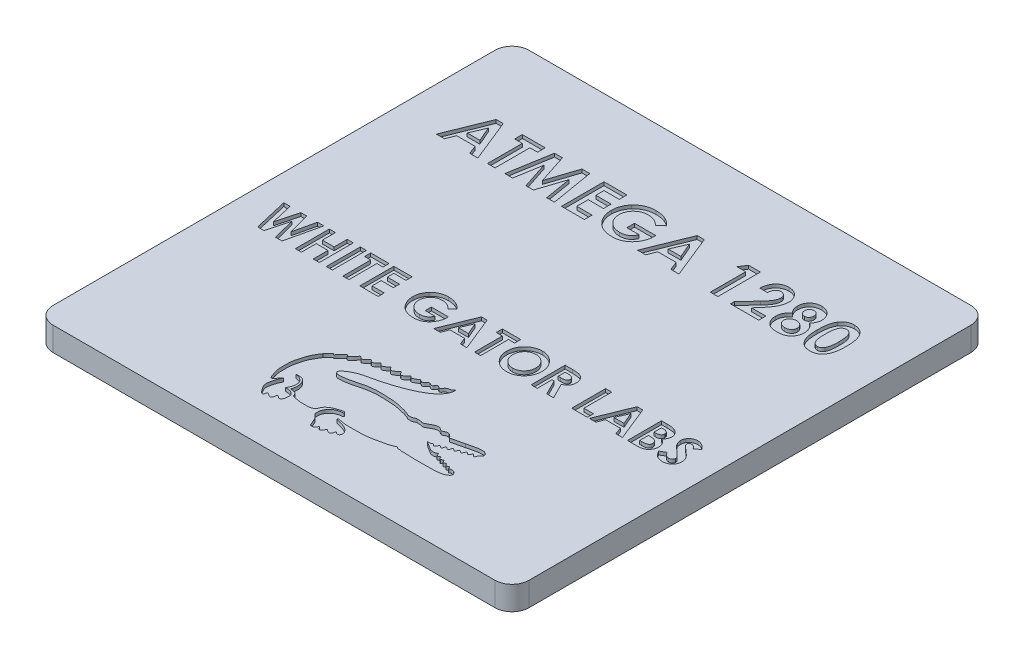
from build123d import *

# Parameters (mm, degrees)
BOSS_EXTRUDE1_DEPTH = 0.7
SKETCH2_W           = 0.179487179
SKETCH2_H           = 1
CUT_EXTRUDE1_DEPTH  = 0.1


with BuildPart() as part:
    # Sketch1 → Boss-Extrude1 (new body)
    with BuildSketch(Plane(origin=(0, 0, 0), x_dir=(1, 0, 0), z_dir=(0, 1, 0))):
        with BuildLine():
            Line((7, -6.5), (7, 6.5))
            ThreePointArc((7, 6.5), (6.853553391, 6.853553391), (6.5, 7))
            Line((6.5, 7), (-6.5, 7))
            ThreePointArc((-6.5, 7), (-6.853553391, 6.853553391), (-7, 6.5))
            Line((-7, 6.5), (-7, -6.5))
            ThreePointArc((-7, -6.5), (-6.853553391, -6.853553391), (-6.5, -7))
            Line((-6.5, -7), (6.5, -7))
            ThreePointArc((6.5, -7), (6.853553391, -6.853553391), (7, -6.5))
        make_face()
    extrude(amount=BOSS_EXTRUDE1_DEPTH)

    # Sketch2 → Cut-Extrude1 (cut)
    # profile 1 of 25: a face of its own
    with BuildSketch(Plane(origin=(0, 0.7, 0), x_dir=(1, 0, 0), z_dir=(0, 1, 0))):
        with BuildLine():
            add(Edge.make_bspline(
                [(1.068659009, -2.732616389), (1.043393245, -2.804148534), (0.925934698, -2.786741034), (0.85120282, -2.866356433), (0.78730924, -2.944080723), (0.748667825, -2.899244994), (0.702502021, -2.873302028), (0.659151219, -2.926460464), (0.614665362, -2.988791742), (0.556604203, -2.945457693), (0.488437674, -2.926050449), (0.446178629, -2.987097206), (0.389988594, -3.037851704), (0.334909293, -3.00971926), (0.290832894, -2.983162499), (0.254773732, -3.014431267), (0.217372603, -3.036341881), (0.176352384, -3.059884517), (0.142134489, -3.076733451), (0.114963163, -3.078218886), (0.091766343, -3.075049394), (0.084939087, -3.055875659), (0.076092196, -3.039862669), (0.055766471, -3.038403251), (0.034144244, -3.047145086), (0.017212542, -3.076777336), (-0.013977929, -3.112120876), (-0.052068152, -3.139928669), (-0.087796887, -3.154621654), (-0.107840467, -3.154815379), (-0.127002494, -3.148547591), (-0.155823367, -3.13857766), (-0.166313483, -3.104094538), (-0.176633061, -3.071376002), (-0.202197139, -3.068699796), (-0.215347451, -3.083717897), (-0.239501644, -3.100813661), (-0.27067147, -3.132236805), (-0.311304123, -3.159989453), (-0.353572327, -3.178800871), (-0.396154891, -3.181755323), (-0.425500156, -3.154807493), (-0.435502673, -3.131007688), (-0.439090986, -3.109812), (-0.454180938, -3.105750392), (-0.47117515, -3.10530643), (-0.483298146, -3.120424327), (-0.525050297, -3.157200908), (-0.57010595, -3.191213435), (-0.630483645, -3.214428554), (-0.656429864, -3.19716839), (-0.672142798, -3.173830966), (-0.688457286, -3.154767179), (-0.713609528, -3.145028455), (-0.73537423, -3.163388493), (-0.760083922, -3.192153029), (-0.791594513, -3.224794723), (-0.830105387, -3.249049399), (-0.862052273, -3.258547748), (-0.893087665, -3.251553609), (-0.909912148, -3.229586606), (-0.923750238, -3.201179575), (-0.948368049, -3.209347083), (-0.968406902, -3.213829963), (-0.98426273, -3.231806675), (-1.022522007, -3.273184698), (-1.059428443, -3.30955333), (-1.103565741, -3.337346306), (-1.115728836, -3.331442927), (-1.127273114, -3.322045988), (-1.138325448, -3.307872416), (-1.15077985, -3.294136296), (-1.16281223, -3.278965155), (-1.183664218, -3.273842754), (-1.200567694, -3.286972927), (-1.223462874, -3.313016537), (-1.256670348, -3.355193362), (-1.30360932, -3.405865271), (-1.348579973, -3.437443682), (-1.369488771, -3.464629662), (-1.38585577, -3.464658247), (-1.383530611, -3.454201747), (-1.390641039, -3.444992717), (-1.392967339, -3.425629942), (-1.42563098, -3.429269708), (-1.446706721, -3.44778382), (-1.477206998, -3.479595668), (-1.517821643, -3.519557032), (-1.560205121, -3.574032938), (-1.597501065, -3.605022986), (-1.612183439, -3.629484255), (-1.62420788, -3.627766701), (-1.629908217, -3.618744694), (-1.63600409, -3.612396223), (-1.64242331, -3.606988296), (-1.651441093, -3.607714384), (-1.666207165, -3.61570994), (-1.683410412, -3.639722513), (-1.740001212, -3.678630127), (-1.772329389, -3.729375888), (-1.802212605, -3.76039792)],
                knots=[0, 0, 0, 0, 0.048216964, 0.074016797, 0.097146327, 0.105851474, 0.117815555, 0.135225849, 0.154494981, 0.169728567, 0.186348302, 0.206896535, 0.224494547, 0.24212171, 0.253157166, 0.262095112, 0.277179678, 0.290164456, 0.300936228, 0.307748895, 0.312915849, 0.318200696, 0.32336765, 0.326572059, 0.333893275, 0.341325846, 0.35385996, 0.372719752, 0.379456636, 0.38534787, 0.388647011, 0.39614834, 0.408917819, 0.416224996, 0.422133634, 0.42567302, 0.432113802, 0.446565651, 0.461900012, 0.472180102, 0.484818768, 0.494044212, 0.502532058, 0.506728757, 0.509729664, 0.514353175, 0.519954194, 0.524425114, 0.560718987, 0.566270568, 0.575283028, 0.583005511, 0.589877136, 0.595845273, 0.602707975, 0.610898906, 0.627979605, 0.639327312, 0.648132297, 0.654752639, 0.663856415, 0.670956084, 0.676433509, 0.682355267, 0.68801786, 0.695367776, 0.72906036, 0.732220991, 0.735224284, 0.739168979, 0.744684113, 0.749827113, 0.754490251, 0.760478345, 0.764980145, 0.771212726, 0.789299007, 0.808977523, 0.827723076, 0.834537149, 0.836225223, 0.83845088, 0.841006564, 0.846040448, 0.851443182, 0.862598446, 0.869814475, 0.887479591, 0.909678498, 0.925708535, 0.928453283, 0.93126303, 0.933788563, 0.936971817, 0.938649938, 0.940356503, 0.943965021, 0.952207579, 0.964086486, 1, 1, 1, 1], degree=3))
            add(Edge.make_bspline(
                [(-1.802212605, -3.76039792), (-1.811903354, -3.781456642), (-1.842541002, -3.815483847), (-1.876292054, -3.875923952), (-1.914943433, -3.942793438), (-1.958122945, -4.024891161), (-1.991198684, -4.119578047), (-2.017984249, -4.217692264), (-2.040495442, -4.30060481), (-2.058013138, -4.381447633), (-2.069639541, -4.472361404), (-2.071810432, -4.596761753), (-2.073646014, -4.728511541), (-2.060276804, -4.85902275), (-2.02870512, -4.96934139), (-1.988989855, -5.058935993), (-1.969537176, -5.119000077), (-1.944083949, -5.139068137), (-1.92540876, -5.131008528), (-1.901935836, -5.128108238), (-1.871949445, -5.100705842), (-1.848886281, -5.060571845), (-1.828967949, -5.013931894), (-1.8034426, -4.986103127), (-1.784392466, -4.969043281), (-1.774877588, -4.957269986), (-1.762746954, -4.95714852), (-1.764543488, -4.972849475), (-1.77643632, -4.983520077), (-1.78597977, -5.008034698), (-1.802980316, -5.0387303), (-1.821803686, -5.091013784), (-1.84092367, -5.151128703), (-1.85717913, -5.210417669), (-1.862879144, -5.262344101), (-1.876508102, -5.303757153), (-1.874819634, -5.346496845), (-1.876934178, -5.388436378), (-1.862760898, -5.432632589), (-1.843240796, -5.472431792), (-1.822808165, -5.51517021), (-1.792146323, -5.557180373), (-1.755833678, -5.599026225), (-1.729961503, -5.642546221), (-1.697110085, -5.667348411), (-1.665571529, -5.670970269), (-1.645223882, -5.65364044), (-1.6387732, -5.632030317), (-1.639290638, -5.612939884), (-1.640480228, -5.598553085), (-1.635461306, -5.585699544), (-1.626758667, -5.576807284), (-1.614835371, -5.571826761), (-1.601191761, -5.573751837), (-1.583632424, -5.57560154), (-1.573024255, -5.591180333), (-1.552319208, -5.598658132), (-1.535624138, -5.616096953), (-1.508402597, -5.632134563), (-1.470540063, -5.643461015), (-1.450695228, -5.613837311), (-1.430164052, -5.594328896), (-1.42499559, -5.563924171), (-1.424694471, -5.537357796), (-1.423505139, -5.511856432), (-1.40771655, -5.49854581), (-1.389594047, -5.490469124), (-1.372253537, -5.502739644), (-1.350391357, -5.514193657), (-1.331938382, -5.532923835), (-1.306012812, -5.548451763), (-1.267681876, -5.535604459), (-1.244035078, -5.495774098), (-1.213582073, -5.436248905), (-1.220838187, -5.369516199), (-1.211126037, -5.309246445), (-1.227854154, -5.272209103), (-1.247677679, -5.243194718), (-1.275077114, -5.219235086), (-1.306808554, -5.206262606), (-1.337301377, -5.188513201), (-1.369844569, -5.179263456), (-1.419143583, -5.171994905), (-1.448472233, -5.171648686), (-1.483641126, -5.174025766), (-1.481399863, -5.161378571), (-1.470094686, -5.140740873), (-1.447231635, -5.101612425), (-1.427486754, -5.045384283), (-1.411387588, -4.983635268), (-1.405110641, -4.909324392), (-1.41570142, -4.83954478), (-1.454704787, -4.782468096), (-1.496796191, -4.74519709), (-1.540184522, -4.713024234), (-1.588576293, -4.69710941), (-1.631738533, -4.688122057), (-1.65576753, -4.684579211), (-1.670369148, -4.679689659), (-1.614808212, -4.666087994), (-1.59215477, -4.67975575), (-1.540553328, -4.672801517), (-1.513114046, -4.681316487), (-1.486273519, -4.691502957), (-1.457826813, -4.705917122), (-1.434187237, -4.730307866), (-1.406536464, -4.758835135), (-1.383942139, -4.795378767), (-1.366457736, -4.832617561), (-1.357018565, -4.870080862), (-1.348104501, -4.909425617), (-1.348350941, -4.954663095), (-1.34849991, -5.001871414), (-1.360701946, -5.052838301), (-1.361781263, -5.092342507), (-1.382008579, -5.124347166), (-1.37139931, -5.133543667), (-1.357887678, -5.13503223), (-1.334377743, -5.140352), (-1.301643562, -5.14064078), (-1.269843645, -5.152041373), (-1.239744144, -5.156910365), (-1.18768033, -5.181181083), (-1.170738182, -5.230691529), (-1.163825271, -5.272566476), (-1.155212016, -5.273609539), (-1.128601211, -5.279681613), (-1.092321183, -5.291169016), (-1.050695835, -5.300035231), (-1.008727338, -5.306956197), (-0.963294812, -5.312840002), (-0.916458678, -5.323095385), (-0.878764811, -5.326899998), (-0.838991495, -5.324438643), (-0.789014628, -5.323721208), (-0.735373654, -5.323073924), (-0.681364827, -5.324058505), (-0.63184569, -5.32636382), (-0.583326688, -5.307321331), (-0.534114308, -5.286274576), (-0.480924585, -5.233845386), (-0.472325203, -5.177790971), (-0.453401936, -5.147367103)],
                knots=[0, 0, 0, 0, 0.011292471, 0.022299946, 0.033937002, 0.049308133, 0.067810405, 0.083097206, 0.099329487, 0.110042388, 0.123746725, 0.14430867, 0.171171957, 0.188483957, 0.208652631, 0.227111553, 0.23711153, 0.238855018, 0.242007422, 0.245967031, 0.25057812, 0.261004501, 0.268814533, 0.275270497, 0.279338097, 0.281420859, 0.282633912, 0.283841969, 0.28754428, 0.290724694, 0.296449337, 0.304901191, 0.3178933, 0.327543232, 0.335023517, 0.343551178, 0.348646619, 0.355939403, 0.364059678, 0.371053325, 0.377796758, 0.387292359, 0.396499635, 0.405032171, 0.41198881, 0.416064546, 0.419423934, 0.424192529, 0.426622174, 0.428837439, 0.431212885, 0.433133024, 0.434831613, 0.43733374, 0.439829736, 0.443123887, 0.445810067, 0.450441767, 0.454608575, 0.46190491, 0.465987075, 0.470747657, 0.475758024, 0.480319495, 0.48423235, 0.487455412, 0.490017263, 0.493235548, 0.496917513, 0.502389629, 0.506103485, 0.511015671, 0.520157141, 0.528135981, 0.543489078, 0.55207064, 0.5573519, 0.562929026, 0.569364614, 0.574846924, 0.579708043, 0.586635932, 0.591432736, 0.603610926, 0.604429179, 0.605144359, 0.608671362, 0.617239528, 0.626493636, 0.638192461, 0.6483949, 0.663163155, 0.671649054, 0.681816295, 0.690801194, 0.697820249, 0.706956357, 0.711272121, 0.711750836, 0.712906472, 0.72818428, 0.732900331, 0.736848915, 0.742241926, 0.74705295, 0.752346876, 0.758799277, 0.766575694, 0.773328212, 0.778940585, 0.785535919, 0.7930905, 0.801066332, 0.808798121, 0.818211375, 0.822203991, 0.823124689, 0.824553131, 0.828767853, 0.835042293, 0.840420613, 0.845231284, 0.850034933, 0.867854154, 0.868397769, 0.869422214, 0.871420983, 0.882676826, 0.887419492, 0.892446017, 0.903561426, 0.909938253, 0.916007869, 0.922109903, 0.929498632, 0.940595054, 0.948448249, 0.956154125, 0.964622924, 0.973681947, 0.982416276, 1, 1, 1, 1], degree=3))
            add(Edge.make_bspline(
                [(-0.453401936, -5.147367103), (-0.444833057, -5.138075572), (-0.430446451, -5.113812708), (-0.390280361, -5.074899835), (-0.337125295, -5.036281548), (-0.274315356, -4.996106266), (-0.203838091, -4.973344656), (-0.139825275, -4.952845864), (-0.091376961, -4.93306462), (-0.056739792, -4.932464588), (-0.030844934, -4.924430934), (-0.004811866, -4.919903511), (0.01293934, -4.933371198), (0.013872249, -4.951655988), (0.002819256, -4.968072634), (-0.026934955, -4.973945925), (-0.061169225, -4.971213908), (-0.100168933, -4.98392477), (-0.132090237, -4.990560484), (-0.187111073, -5.009694547), (-0.248440606, -5.039928631), (-0.28899843, -5.086954709), (-0.318695331, -5.11571583), (-0.346713353, -5.153607218), (-0.371500351, -5.205788426), (-0.394183386, -5.256193942), (-0.389793469, -5.293658287), (-0.394010831, -5.327424265), (-0.391191171, -5.362163563), (-0.395616576, -5.404413856), (-0.369602615, -5.430604551), (-0.343297608, -5.454322617), (-0.317449841, -5.48171332), (-0.286579835, -5.511944981), (-0.259427957, -5.541943396), (-0.246801101, -5.573673208), (-0.237482497, -5.604463465), (-0.222505547, -5.639902674), (-0.201054646, -5.680587311), (-0.182317199, -5.724113717), (-0.167194489, -5.7603827), (-0.140781222, -5.771118144), (-0.12038212, -5.769047507), (-0.095612281, -5.772790919), (-0.06694551, -5.757912442), (-0.03926779, -5.734785866), (-0.016066916, -5.708835088), (-0.009827553, -5.684874419), (-0.000960366, -5.672096812), (0.012869184, -5.671268074), (0.024865277, -5.688358479), (0.037996964, -5.708205478), (0.057686027, -5.730719584), (0.075351972, -5.74907235), (0.105840997, -5.753819827), (0.127687816, -5.727820468), (0.149953816, -5.702312196), (0.161741817, -5.671666896), (0.178198348, -5.648665529), (0.177083117, -5.624643328), (0.196437335, -5.617123039), (0.205676609, -5.636308807), (0.224959152, -5.650120126), (0.24927325, -5.667512415), (0.281627003, -5.682495844), (0.331130049, -5.686554493), (0.363074944, -5.638727988), (0.368319569, -5.603287039), (0.367332015, -5.579771026), (0.374274731, -5.567446451), (0.389540276, -5.551909332), (0.412116554, -5.566224857), (0.424963092, -5.583285538), (0.446013712, -5.594354442), (0.476165388, -5.607868468), (0.515486461, -5.577622851), (0.558973258, -5.488921157), (0.485338396, -5.397613543), (0.448874596, -5.366030771)],
                knots=[0, 0, 0, 0, 0.013276178, 0.029430013, 0.058362889, 0.082475503, 0.107406099, 0.135767828, 0.153617856, 0.161689362, 0.171706135, 0.182591217, 0.187314135, 0.193219481, 0.199941134, 0.206263784, 0.223752585, 0.236038349, 0.248873999, 0.258080175, 0.297357349, 0.318573554, 0.322951182, 0.34086593, 0.367575759, 0.384252202, 0.397411237, 0.406422835, 0.419883613, 0.434503825, 0.448292332, 0.45594766, 0.472232842, 0.487649979, 0.501620897, 0.514265952, 0.523127689, 0.535517016, 0.554693811, 0.571193172, 0.586428807, 0.593100844, 0.599506179, 0.607865188, 0.618812007, 0.631780822, 0.646414071, 0.653922814, 0.657826283, 0.661848474, 0.666146811, 0.678354609, 0.687637135, 0.697562095, 0.704452379, 0.717194003, 0.729381038, 0.740859679, 0.751175736, 0.758667171, 0.763451741, 0.767118387, 0.778224312, 0.788973136, 0.798201563, 0.81608951, 0.834980217, 0.851289468, 0.854120789, 0.85930277, 0.865993045, 0.873735327, 0.882605858, 0.889167539, 0.898502369, 0.91523045, 0.933533079, 1, 1, 1, 1], degree=3))
            add(Edge.make_bspline(
                [(0.448874596, -5.366030771), (0.419807337, -5.343315292), (0.364821321, -5.310034467), (0.281072112, -5.273580513), (0.209163059, -5.257093944), (0.145937128, -5.239706994), (0.103631281, -5.233847676), (0.071801925, -5.225500473), (0.065962381, -5.199064354), (0.092284952, -5.188335931), (0.114919967, -5.196587082), (0.154516452, -5.202556555), (0.205625669, -5.216444887), (0.275651693, -5.223441509), (0.348491537, -5.235037826), (0.454337897, -5.237894221), (0.635752768, -5.234612781), (0.918943796, -5.235745032), (1.274356883, -5.162312524), (1.530196995, -5.107881843), (1.65296465, -5.041077775), (1.666809444, -5.043872455), (1.687799146, -5.056960974), (1.725807619, -5.080406213), (1.772489534, -5.070560067), (1.817876639, -5.088338307), (1.8632098, -5.082929383), (1.928995894, -5.083597272), (2.000235954, -5.091759424), (2.08439731, -5.091466273), (2.155964708, -5.090300186), (2.235080209, -5.10080018), (2.328293565, -5.096739756), (2.482550234, -5.09912534), (2.633790537, -5.096386521), (2.771951496, -5.099867538), (2.897022899, -5.085988268), (2.995359551, -5.074746979), (3.059908516, -5.049724764)],
                knots=[0, 0, 0, 0, 0.031947682, 0.055620488, 0.078812347, 0.095960836, 0.112075546, 0.116761877, 0.123004295, 0.129425947, 0.136592297, 0.143897009, 0.164037534, 0.182449568, 0.20482689, 0.227974837, 0.274131209, 0.362396203, 0.472777382, 0.587782208, 0.589110406, 0.591036727, 0.599391077, 0.61084794, 0.628309445, 0.637774367, 0.652280259, 0.66699046, 0.695046005, 0.714252076, 0.73999817, 0.757023687, 0.783308651, 0.820705619, 0.890915412, 0.914559947, 0.94042783, 1, 1, 1, 1], degree=3))
            add(Edge.make_bspline(
                [(3.059908516, -5.049724764), (3.09682978, -5.040063341), (3.140478628, -5.013123618), (3.186619643, -4.965040594), (3.186136612, -4.933716381), (3.187673822, -4.91131114), (3.174893766, -4.885057374), (3.152686277, -4.856954171), (3.116202632, -4.831472825), (3.074202229, -4.821115374), (3.032902064, -4.821063732), (3.005344875, -4.827163035), (2.995572369, -4.853357052), (2.989637656, -4.847739497), (2.981998687, -4.851761114), (2.981070261, -4.840008927), (2.97294193, -4.834542511), (2.968519004, -4.821111113), (2.959276917, -4.806289343), (2.949932999, -4.790533541), (2.938603519, -4.779660839), (2.92750013, -4.779083666), (2.918156805, -4.780502161), (2.910250573, -4.786449072), (2.903500023, -4.794667202), (2.891964388, -4.796730762), (2.88551319, -4.807175549), (2.873566582, -4.806154178), (2.860997874, -4.810196244), (2.854757141, -4.796604513), (2.847518389, -4.787194606), (2.840991666, -4.777116894), (2.834897897, -4.767268541), (2.828450298, -4.758516149), (2.8238495, -4.744760744), (2.807715334, -4.74933542), (2.795896082, -4.74656807), (2.781831757, -4.750467957), (2.769115574, -4.757250713), (2.755234778, -4.76774845), (2.743639093, -4.76542602), (2.734923245, -4.767041825), (2.730201649, -4.75767702), (2.724991442, -4.746591571), (2.714942612, -4.729016051), (2.702981696, -4.711338409), (2.688694961, -4.684853679), (2.657424729, -4.703303058), (2.643626805, -4.714146606), (2.627494283, -4.724585204)],
                knots=[0, 0, 0, 0, 0.116546071, 0.171978945, 0.193508718, 0.214321362, 0.242768959, 0.283280105, 0.328295166, 0.381564296, 0.418486365, 0.458732166, 0.472204911, 0.475170927, 0.481196785, 0.492391505, 0.499561578, 0.512517907, 0.535049779, 0.555737592, 0.571405939, 0.581908311, 0.589881076, 0.601112492, 0.61253128, 0.622685485, 0.636539895, 0.645930541, 0.659361927, 0.672182485, 0.686144983, 0.699009795, 0.71007957, 0.722752973, 0.735213602, 0.748490634, 0.766903163, 0.77485258, 0.79395513, 0.813798817, 0.825742079, 0.830967256, 0.839633125, 0.853704709, 0.872929063, 0.901651107, 0.928936126, 0.946032292, 1, 1, 1, 1], degree=3))
            add(Edge.make_bspline(
                [(2.627494283, -4.724585204), (2.621584757, -4.725047353), (2.612196084, -4.731524171), (2.599285628, -4.724312078), (2.594496168, -4.713354847), (2.583922638, -4.692775017), (2.576973006, -4.670936848), (2.561551806, -4.654057706), (2.5495162, -4.653758343), (2.538872963, -4.659984914), (2.525547887, -4.667719006), (2.510478627, -4.676320512), (2.497366191, -4.682935822), (2.482970047, -4.685218293), (2.474119055, -4.672269548), (2.465538691, -4.652526863), (2.456309742, -4.631842484), (2.448263464, -4.612112391), (2.435131713, -4.602388533), (2.424691994, -4.609048667), (2.413360864, -4.614778774), (2.39389349, -4.626837997), (2.357937085, -4.636933561), (2.313372759, -4.637222683), (2.27179756, -4.637457779), (2.231500657, -4.626094606), (2.193385626, -4.603209399), (2.143518959, -4.573776591), (2.096864378, -4.544067069), (2.033071306, -4.504286994), (2.007970825, -4.490008759), (1.965061368, -4.457917484), (1.971511002, -4.45876223), (1.978054436, -4.45840361), (2.013153395, -4.458385845), (2.062533204, -4.469667182), (2.09156981, -4.435204463), (2.110640856, -4.42855386), (2.122861066, -4.435148304), (2.132434972, -4.445536811), (2.145431732, -4.454378587), (2.156736102, -4.464867394), (2.167564818, -4.474997507), (2.181951583, -4.477939741), (2.196243818, -4.472201644), (2.212642866, -4.457692069), (2.227584471, -4.424883674), (2.2418553, -4.399466172), (2.256609656, -4.372918633), (2.271954602, -4.379916141), (2.285687806, -4.396634565), (2.307206786, -4.411162904), (2.330465314, -4.422814203), (2.349633411, -4.413953545), (2.356401461, -4.394146374), (2.364831128, -4.373690474), (2.367680973, -4.3519213), (2.371282038, -4.333401859), (2.383899183, -4.319582388), (2.403854931, -4.321383005), (2.422108708, -4.332972006), (2.439688195, -4.348865737), (2.457710841, -4.359646298), (2.47453568, -4.374372477), (2.497848059, -4.3549024), (2.495888848, -4.334484919), (2.50086605, -4.321428262)],
                knots=[0, 0, 0, 0, 0.012279565, 0.017915052, 0.02627493, 0.034934062, 0.063098495, 0.070685493, 0.076795485, 0.084706328, 0.09430205, 0.106898031, 0.118255382, 0.123208516, 0.133348035, 0.143982626, 0.16697784, 0.176089533, 0.186449054, 0.192438747, 0.198312126, 0.211604089, 0.236513557, 0.26967831, 0.298060255, 0.316841929, 0.350190941, 0.384056578, 0.429000283, 0.460132727, 0.521155486, 0.524459791, 0.526803918, 0.529734078, 0.538915243, 0.59276395, 0.614565596, 0.62143604, 0.629926201, 0.639335212, 0.649220851, 0.660154879, 0.669492647, 0.677461148, 0.687159734, 0.698241092, 0.719487972, 0.754518686, 0.762314447, 0.769011535, 0.781856569, 0.805945372, 0.819100832, 0.829390607, 0.842334276, 0.858062279, 0.872693837, 0.884767394, 0.894388945, 0.905805497, 0.919872007, 0.936456105, 0.950946567, 0.962907166, 0.972927188, 1, 1, 1, 1], degree=3))
            add(Edge.make_bspline(
                [(2.50086605, -4.321428262), (2.506187779, -4.305017038), (2.505401937, -4.276256835), (2.53406211, -4.260071428), (2.553215387, -4.267037964), (2.571044981, -4.282237354), (2.589630709, -4.29582024), (2.612702416, -4.31713248), (2.639031626, -4.283520323), (2.643820828, -4.25009954), (2.658383714, -4.221006999), (2.677658171, -4.20119048), (2.693417479, -4.217089373), (2.713126728, -4.224087434), (2.728366044, -4.241118836), (2.749981375, -4.25382305), (2.77845492, -4.244183662), (2.782764269, -4.215280804), (2.795916548, -4.187193017), (2.808651817, -4.1660449), (2.826279286, -4.146084351), (2.846136478, -4.152994032), (2.859027627, -4.169430643), (2.874363582, -4.186437131), (2.901692963, -4.206199066), (2.934403209, -4.168487345), (2.943946068, -4.134833634), (2.962597714, -4.107688913), (2.981143211, -4.105773997), (2.989899423, -4.118892078), (3.005455895, -4.128761866), (3.018086411, -4.145200081), (3.032972286, -4.160325232), (3.055267006, -4.158002552), (3.073330337, -4.131587159), (3.077678034, -4.101694825), (3.08287903, -4.072704427), (3.103917224, -4.058248828), (3.133865968, -4.048363118), (3.168248826, -4.010173918), (3.165846535, -3.953915652), (3.134839615, -3.915663661), (3.097936997, -3.893004451), (3.057252217, -3.878716643), (3.01935183, -3.880845124), (2.982814617, -3.880279099), (2.949716154, -3.880319327), (2.911856471, -3.882613194), (2.878049591, -3.890920208), (2.841801385, -3.897934515), (2.806693426, -3.908174182), (2.768056029, -3.915491166), (2.729113822, -3.921090426), (2.692634904, -3.933123096), (2.647816464, -3.941994978), (2.615340257, -3.953519872), (2.592997208, -3.957847421)],
                knots=[0, 0, 0, 0, 0.032452064, 0.043004835, 0.053245941, 0.066769083, 0.084815251, 0.098003839, 0.112840312, 0.145120866, 0.162081124, 0.173876907, 0.18503046, 0.195112401, 0.212342685, 0.225207224, 0.23791445, 0.259139212, 0.272300465, 0.294080065, 0.305739868, 0.314199341, 0.327606525, 0.342984262, 0.357157547, 0.38004449, 0.41242784, 0.428075336, 0.433326608, 0.443080605, 0.453194905, 0.46673733, 0.480816063, 0.487976366, 0.504123157, 0.532442624, 0.544591911, 0.554196226, 0.576223135, 0.601695493, 0.640748728, 0.665285102, 0.688091844, 0.718331267, 0.741128082, 0.75591888, 0.784292613, 0.800791796, 0.824130423, 0.846862845, 0.86736577, 0.889975066, 0.917733063, 0.938104972, 0.959047903, 1, 1, 1, 1], degree=3))
            add(Edge.make_bspline(
                [(2.592997208, -3.957847421), (2.570255799, -3.961719959), (2.535044893, -3.971605486), (2.487808272, -3.98203053), (2.451326701, -3.989183471), (2.414565484, -3.997452199), (2.376354951, -4.007175909), (2.337377219, -4.015254359), (2.301028218, -4.022609434), (2.267871627, -4.033624682), (2.238051381, -4.040641361), (2.217820362, -4.049692591), (2.202778783, -4.049143503), (2.197163825, -4.040797787), (2.188732745, -4.026897352), (2.178945811, -4.008328903), (2.155316015, -3.986159044), (2.126888637, -3.963070036), (2.094223432, -3.938812461), (2.052798966, -3.937466139), (2.018268869, -3.934735698), (1.97908167, -3.950245586), (1.955431801, -3.972080735), (1.921362495, -3.979303456), (1.891998735, -3.980971388), (1.864057731, -3.964125603), (1.846700184, -3.948349724), (1.813730802, -3.926851568), (1.749174126, -3.912318474), (1.671871513, -3.931172685), (1.612117386, -3.964779545), (1.565431833, -3.992110938), (1.51805149, -4.017872687), (1.472866289, -4.036285615), (1.440463018, -4.058174321), (1.398449622, -4.056975501), (1.361139724, -4.035700044), (1.300520064, -4.036497471), (1.261575931, -4.033627695), (1.235341041, -4.035794285)],
                knots=[0, 0, 0, 0, 0.047002016, 0.074580583, 0.098698164, 0.122867516, 0.151467764, 0.179139021, 0.204124939, 0.227030057, 0.250434853, 0.266286497, 0.272441733, 0.278680534, 0.285281638, 0.306306361, 0.320614767, 0.350898754, 0.382219686, 0.399602264, 0.434254654, 0.451623351, 0.484206387, 0.497343853, 0.522159153, 0.541773663, 0.561792769, 0.570227473, 0.621862165, 0.690650076, 0.727533694, 0.761682827, 0.801147075, 0.837190087, 0.86192917, 0.878108141, 0.919975542, 0.946367323, 1, 1, 1, 1], degree=3))
            add(Edge.make_bspline(
                [(1.235341041, -4.035794285), (1.219518016, -4.035046813), (1.190288771, -4.052380801), (1.141370763, -4.075019855), (1.079923275, -4.078157111), (1.014970392, -4.079808311), (0.950150357, -4.03998389), (0.900947989, -4.025361563), (0.869892783, -4.014588575)],
                knots=[0, 0, 0, 0, 0.122508249, 0.251504586, 0.420804394, 0.597875196, 0.744140471, 1, 1, 1, 1], degree=3))
            add(Edge.make_bspline(
                [(0.869892783, -4.014588575), (0.81814598, -3.994069557), (0.750398041, -3.988025937), (0.672898808, -3.962853029), (0.634035928, -3.953062615), (0.591435639, -3.94755186), (0.54711666, -3.939026799), (0.499452952, -3.930080077), (0.427972241, -3.919576259), (0.330261696, -3.915267554), (0.184237401, -3.903092568), (0.035198566, -3.911290545), (-0.090204911, -3.901796188), (-0.176074528, -3.917294882), (-0.245718345, -3.922193419), (-0.324711777, -3.931570344), (-0.393694972, -3.947334915), (-0.450657288, -3.963284758), (-0.500977933, -3.97430093), (-0.555743285, -3.991220742), (-0.632667213, -4.007830293), (-0.725481726, -4.03477522), (-0.808080344, -4.048897655), (-0.906087435, -4.06579716), (-0.984774657, -4.066294426), (-1.066786354, -4.072696981), (-1.105161981, -4.053157584), (-1.130802889, -4.026671797), (-1.134216335, -3.990291823), (-1.109609721, -3.956313795), (-1.057247776, -3.903590086), (-0.980303939, -3.844697171), (-0.884202463, -3.802767497), (-0.804240117, -3.759100372), (-0.726797594, -3.736748415), (-0.653589271, -3.712322847), (-0.571322576, -3.695864846), (-0.476405942, -3.672755792), (-0.370050723, -3.651998031), (-0.272682924, -3.625627166), (-0.167539543, -3.593245317), (-0.052744335, -3.565916481), (0.062990741, -3.527707266), (0.174473838, -3.490909174), (0.329268173, -3.431692397), (0.515756154, -3.355558122), (0.717337111, -3.245867774), (0.889975626, -3.130098109), (1.010844556, -2.995239394), (1.075461907, -2.859199877), (1.095416769, -2.76990215), (1.068659009, -2.732616389)],
                knots=[0, 0, 0, 0, 0.034896265, 0.042334571, 0.051392618, 0.060136789, 0.069415094, 0.079868894, 0.090742842, 0.114971131, 0.141540014, 0.183100139, 0.209109245, 0.220294865, 0.237991348, 0.253160385, 0.270440165, 0.28257517, 0.290489217, 0.30293106, 0.318710993, 0.340125825, 0.363845044, 0.371563876, 0.402788182, 0.413927278, 0.42222723, 0.42911126, 0.436434221, 0.442974809, 0.454752885, 0.483685683, 0.503112761, 0.520858935, 0.540980384, 0.553762703, 0.569548987, 0.593836618, 0.615430556, 0.637896306, 0.657454294, 0.684851583, 0.712299562, 0.734326224, 0.758931993, 0.816879492, 0.861279783, 0.903493722, 0.947904783, 0.972512297, 1, 1, 1, 1], degree=3))
        make_face()
    # profile 2 of 25: a face of its own
    with BuildSketch(Plane(origin=(0, 0.7, 0), x_dir=(1, 0, 0), z_dir=(0, 1, 0))):
        Polygon((-5.22002032, 4.753703798), (-5.011937387, 4.753703798), (-4.507129695, 3.503703798), (-4.746763109, 3.503703798), (-4.843918557, 3.760114054), (-5.388539951, 3.760114054), (-5.4856954, 3.503703798), (-5.725078413, 3.503703798), align=None)
        Polygon((-5.116104054, 4.41841734), (-5.303403734, 3.984473029), (-4.928804375, 3.984473029), align=None, mode=Mode.SUBTRACT)
    # profile 3 of 25: a face of its own
    with BuildSketch(Plane(origin=(0, 0.7, 0), x_dir=(1, 0, 0), z_dir=(0, 1, 0))):
        Polygon((-4.451039951, 4.753703798), (-3.777963028, 4.753703798), (-3.777963028, 4.529344824), (-4.002322003, 4.529344824), (-4.002322003, 3.503703798), (-4.226680977, 3.503703798), (-4.226680977, 4.529344824), (-4.451039951, 4.529344824), align=None)
    # profile 4 of 25: a face of its own
    with BuildSketch(Plane(origin=(0, 0.7, 0), x_dir=(1, 0, 0), z_dir=(0, 1, 0))):
        Polygon((-3.502772724, 4.753703798), (-3.269900128, 4.753703798), (-2.984693798, 3.881808766), (-2.697484262, 4.753703798), (-2.466865272, 4.753703798), (-2.255527131, 3.503703798), (-2.482640512, 3.503703798), (-2.616104054, 4.293217019), (-2.876019919, 3.503703798), (-3.09487008, 3.503703798), (-3.353283541, 4.293217019), (-3.486496682, 3.503703798), (-3.713860464, 3.503703798), align=None)
    # profile 5 of 25: a face of its own
    with BuildSketch(Plane(origin=(0, 0.7, 0), x_dir=(1, 0, 0), z_dir=(0, 1, 0))):
        Polygon((-2.047193798, 4.753703798), (-1.374116875, 4.753703798), (-1.374116875, 4.529344824), (-1.822834823, 4.529344824), (-1.822834823, 4.288960208), (-1.374116875, 4.288960208), (-1.374116875, 4.064601234), (-1.822834823, 4.064601234), (-1.822834823, 3.728062772), (-1.374116875, 3.728062772), (-1.374116875, 3.503703798), (-2.047193798, 3.503703798), align=None)
    # profile 6 of 25: a face of its own
    with BuildSketch(Plane(origin=(0, 0.7, 0), x_dir=(1, 0, 0), z_dir=(0, 1, 0))):
        with BuildLine():
            Line((-0.004174968, 4.554885689), (-0.173946602, 4.392375673))
            add(Edge.make_bspline(
                [(-0.173946602, 4.392375673), (-0.187387719, 4.405832894), (-0.213761408, 4.432238184), (-0.256892279, 4.466606484), (-0.301562771, 4.495826333), (-0.347919912, 4.519852937), (-0.39602828, 4.53849006), (-0.445792935, 4.55182179), (-0.497294838, 4.559729065), (-0.532159327, 4.560836057), (-0.549797964, 4.561396106)],
                knots=[0, 0, 0, 0, 1.075575784, 2.110457258, 3.113929901, 4.09197124, 5.059417775, 6.02750972, 7.002078037, 8, 8, 8, 8], degree=3))
            add(Edge.make_bspline(
                [(-0.549797964, 4.561396106), (-0.565090123, 4.561003682), (-0.595117618, 4.560233123), (-0.639240129, 4.554381555), (-0.681401891, 4.544606772), (-0.721802094, 4.531065443), (-0.76019408, 4.513443894), (-0.7968003, 4.492014093), (-0.831395478, 4.466612101), (-0.863707203, 4.43771945), (-0.893127133, 4.406174508), (-0.918812285, 4.372410267), (-0.940690516, 4.337056061), (-0.958700763, 4.299931015), (-0.972404602, 4.261092108), (-0.982187349, 4.220567534), (-0.988396962, 4.178475065), (-0.989130131, 4.149759146), (-0.98950149, 4.135214215)],
                knots=[0, 0, 0, 0, 1.075001177, 2.110859044, 3.123021556, 4.114053297, 5.101481495, 6.087880186, 7.091499647, 8.114004866, 9.131394192, 10.11971144, 11.092043119, 12.050101265, 13.015322563, 13.981809771, 14.977764287, 16, 16, 16, 16], degree=3))
            add(Edge.make_bspline(
                [(-0.98950149, 4.135214215), (-0.989155104, 4.120165864), (-0.988472678, 4.090518553), (-0.981917196, 4.04700985), (-0.971817347, 4.005151342), (-0.957033862, 3.96525361), (-0.938839869, 3.926770111), (-0.915766889, 3.890446307), (-0.888861484, 3.855727493), (-0.858171733, 3.823218143), (-0.824789208, 3.793252347), (-0.788634848, 3.76740308), (-0.750808689, 3.745100742), (-0.710700216, 3.727438012), (-0.669005593, 3.713256774), (-0.625301917, 3.703257784), (-0.579687598, 3.697123439), (-0.54856536, 3.69638583), (-0.532770721, 3.69601149)],
                knots=[0, 0, 0, 0, 1.022067601, 2.013613092, 2.983553406, 3.943623673, 4.90013463, 5.87121881, 6.861774014, 7.881098904, 8.905697761, 9.905387765, 10.89678721, 11.884561068, 12.87834324, 13.885584958, 14.926927371, 16, 16, 16, 16], degree=3))
            add(Edge.make_bspline(
                [(-0.532770721, 3.69601149), (-0.522496893, 3.696104189), (-0.502327083, 3.696286178), (-0.472741409, 3.699240366), (-0.444405439, 3.703463722), (-0.417209437, 3.709054944), (-0.391428008, 3.716967526), (-0.366704192, 3.726220316), (-0.343182847, 3.737140454), (-0.320991505, 3.750104704), (-0.299799894, 3.764636043), (-0.27980637, 3.781262985), (-0.260660226, 3.799610654), (-0.24258518, 3.819903192), (-0.225887158, 3.842322039), (-0.210031198, 3.866455218), (-0.195198847, 3.892542237), (-0.186434803, 3.910963568), (-0.181959423, 3.920370465)],
                knots=[0, 0, 0, 0, 1.109579412, 2.178351274, 3.208885622, 4.204702371, 5.174744997, 6.119429583, 7.05542196, 7.97267548, 8.893247984, 9.828544973, 10.778894627, 11.756245826, 12.760884819, 13.796418446, 14.874735809, 16, 16, 16, 16], degree=3))
            Line((-0.181959423, 3.920370465), (-0.540783541, 3.920370465))
            Line((-0.540783541, 3.920370465), (-0.540783541, 4.144729439))
            Line((-0.540783541, 4.144729439), (0.082463654, 4.144729439))
            Line((0.082463654, 4.144729439), (0.084216459, 4.091394102))
            add(Edge.make_bspline(
                [(0.084216459, 4.091394102), (0.083991236, 4.077696235), (0.083541194, 4.050324944), (0.079428275, 4.009573756), (0.072615288, 3.969363048), (0.063301283, 3.929733206), (0.051628478, 3.890489832), (0.036741998, 3.852008714), (0.01931002, 3.814028886), (-0.000221273, 3.776711733), (-0.022168828, 3.74090491), (-0.045798593, 3.707000576), (-0.070773711, 3.675057411), (-0.097637379, 3.645520463), (-0.125971286, 3.61814161), (-0.155831208, 3.593026182), (-0.187322758, 3.570152926), (-0.220279112, 3.549328618), (-0.254887988, 3.53107734), (-0.290959108, 3.515201149), (-0.328438009, 3.501717836), (-0.367421452, 3.490664452), (-0.407832727, 3.482135887), (-0.449672701, 3.476287839), (-0.492964352, 3.472314024), (-0.522328163, 3.471875684), (-0.537277932, 3.471652516)],
                knots=[0, 0, 0, 0, 1.006889344, 2.011981806, 3.007738725, 4.003571281, 5.003404394, 6.015442001, 7.03424805, 8.074616296, 9.110249922, 10.119753985, 11.111721717, 12.089233633, 13.052717867, 14.006597561, 14.955430184, 15.912305663, 16.870361111, 17.829300583, 18.807640451, 19.796414044, 20.806216501, 21.841577364, 22.90109906, 24, 24, 24, 24], degree=3))
            add(Edge.make_bspline(
                [(-0.537277932, 3.471652516), (-0.553228322, 3.471872899), (-0.584846752, 3.472309764), (-0.631598839, 3.476401301), (-0.676994619, 3.483154119), (-0.721045414, 3.492499788), (-0.763853502, 3.50413122), (-0.805345332, 3.518731418), (-0.845436042, 3.536098815), (-0.884245684, 3.555773517), (-0.921278229, 3.578086342), (-0.956450682, 3.602646033), (-0.989571064, 3.629610571), (-1.020978631, 3.658528564), (-1.049939581, 3.690110818), (-1.077533174, 3.723333601), (-1.102422596, 3.75941539), (-1.125678019, 3.797186404), (-1.146338322, 3.836630814), (-1.164406054, 3.877019077), (-1.179814206, 3.918117343), (-1.191963906, 3.96011698), (-1.201828325, 4.002725131), (-1.208886501, 4.04612709), (-1.212872583, 4.090317423), (-1.213529709, 4.120015616), (-1.213860464, 4.134963814)],
                knots=[0, 0, 0, 0, 1.084149091, 2.14910686, 3.187506334, 4.202448172, 5.208724393, 6.201130722, 7.189831603, 8.176984443, 9.156919086, 10.126598231, 11.090766514, 12.05840148, 13.026036446, 14.001772938, 14.991905635, 16.003017641, 17.015720547, 18.016462227, 19.009322657, 19.99686681, 20.986544154, 21.980959929, 22.983742515, 24, 24, 24, 24], degree=3))
            add(Edge.make_bspline(
                [(-1.213860464, 4.134963814), (-1.213417512, 4.155356351), (-1.212542813, 4.195625564), (-1.204441768, 4.254942371), (-1.191813446, 4.312325464), (-1.173690533, 4.367565856), (-1.150434556, 4.420739642), (-1.122374957, 4.47197165), (-1.08890222, 4.521207426), (-1.062992023, 4.551691209), (-1.049848044, 4.56715532)],
                knots=[0, 0, 0, 0, 1.034044851, 2.041932006, 3.031217818, 4.011390712, 4.986069675, 5.97149666, 6.970960976, 8, 8, 8, 8], degree=3))
            add(Edge.make_bspline(
                [(-1.049848044, 4.56715532), (-1.041687077, 4.576101778), (-1.025487679, 4.593860361), (-0.99959297, 4.618536274), (-0.973041564, 4.641732545), (-0.94546572, 4.662957312), (-0.917010399, 4.682675195), (-0.887593702, 4.700516566), (-0.857369941, 4.717049505), (-0.826103408, 4.731429777), (-0.793957787, 4.74432289), (-0.760790711, 4.755232277), (-0.726850594, 4.7648954), (-0.691836896, 4.772246559), (-0.656103337, 4.778368043), (-0.61939627, 4.782470982), (-0.581815724, 4.785478144), (-0.556398133, 4.785662038), (-0.543537948, 4.78575508)],
                knots=[0, 0, 0, 0, 1.020590567, 2.025856924, 3.013483481, 3.991664875, 4.957826714, 5.930500614, 6.890802512, 7.860442893, 8.829981142, 9.809047939, 10.802672283, 11.803273349, 12.823572789, 13.857849586, 14.916166035, 16, 16, 16, 16], degree=3))
            add(Edge.make_bspline(
                [(-0.543537948, 4.78575508), (-0.530094881, 4.785547765), (-0.503348112, 4.785135284), (-0.463580096, 4.782281183), (-0.424364684, 4.777877979), (-0.385867132, 4.771272921), (-0.347958243, 4.763127509), (-0.310834243, 4.752691221), (-0.274252942, 4.740833718), (-0.250438654, 4.73138004), (-0.238549968, 4.726660529)],
                knots=[0, 0, 0, 0, 1.03180557, 2.052914215, 3.058998889, 4.059601663, 5.049854447, 6.033765722, 7.018406786, 8, 8, 8, 8], degree=3))
            add(Edge.make_bspline(
                [(-0.238549968, 4.726660529), (-0.228547108, 4.72229885), (-0.208201569, 4.713427317), (-0.178601317, 4.697196432), (-0.148928744, 4.679202632), (-0.119504032, 4.658788023), (-0.090372015, 4.63599079), (-0.061228524, 4.611171011), (-0.032371067, 4.584039274), (-0.013695387, 4.564729404), (-0.004174968, 4.554885689)],
                knots=[0, 0, 0, 0, 0.894392155, 1.819168899, 2.76525314, 3.739198753, 4.75366411, 5.797420238, 6.877176959, 8, 8, 8, 8], degree=3))
        make_face()
    # profile 7 of 25: a face of its own
    with BuildSketch(Plane(origin=(0, 0.7, 0), x_dir=(1, 0, 0), z_dir=(0, 1, 0))):
        Polygon((0.693441218, 4.753703798), (0.901524151, 4.753703798), (1.406331843, 3.503703798), (1.16669843, 3.503703798), (1.069542981, 3.760114054), (0.524921587, 3.760114054), (0.427766138, 3.503703798), (0.188383125, 3.503703798), align=None)
        Polygon((0.797357484, 4.41841734), (0.610057805, 3.984473029), (0.984657164, 3.984473029), align=None, mode=Mode.SUBTRACT)
    # profile 8 of 25: a face of its own
    with BuildSketch(Plane(origin=(0, 0.7, 0), x_dir=(1, 0, 0), z_dir=(0, 1, 0))):
        Polygon((2.205360289, 4.753703798), (2.552165177, 4.753703798), (2.552165177, 3.503703798), (2.327806202, 3.503703798), (2.327806202, 4.545370465), (2.071395946, 4.545370465), align=None)
    # profile 9 of 25: a face of its own
    with BuildSketch(Plane(origin=(0, 0.7, 0), x_dir=(1, 0, 0), z_dir=(0, 1, 0))):
        with BuildLine():
            Line((3.177165177, 4.337037131), (2.952806202, 4.337037131))
            add(Edge.make_bspline(
                [(2.952806202, 4.337037131), (2.953775174, 4.354008701), (2.955668487, 4.387170129), (2.963199609, 4.435338164), (2.973291052, 4.480851661), (2.986759424, 4.523551408), (3.003683313, 4.563421889), (3.023627226, 4.600599026), (3.047100684, 4.634887079), (3.073604095, 4.666120692), (3.102687502, 4.694140655), (3.133747108, 4.718984914), (3.167258009, 4.739485771), (3.202607934, 4.756356079), (3.239790865, 4.769834671), (3.279158609, 4.7788462), (3.3203703, 4.784948896), (3.34858304, 4.785482907), (3.362962452, 4.78575508)],
                knots=[0, 0, 0, 0, 1.199038563, 2.342849363, 3.436047546, 4.486744587, 5.497670872, 6.488682221, 7.459191391, 8.424610317, 9.374430501, 10.305433194, 11.225809216, 12.140057399, 13.06607119, 14.010487599, 14.985989317, 16, 16, 16, 16], degree=3))
            add(Edge.make_bspline(
                [(3.362962452, 4.78575508), (3.380612977, 4.785204337), (3.415070938, 4.784129158), (3.465141088, 4.774957522), (3.511901134, 4.759616545), (3.555317085, 4.738181153), (3.595019334, 4.710949735), (3.631001298, 4.678480725), (3.662174823, 4.640092908), (3.68873756, 4.597383536), (3.710808019, 4.552160323), (3.726274078, 4.505397645), (3.736439752, 4.458336394), (3.737523984, 4.42664773), (3.738062613, 4.41090532)],
                knots=[0, 0, 0, 0, 1.075374347, 2.099382735, 3.09057751, 4.06680945, 5.040638231, 6.016817125, 7.011024321, 8.044445721, 9.0776792, 10.070479129, 11.0414456, 12, 12, 12, 12], degree=3))
            add(Edge.make_bspline(
                [(3.738062613, 4.41090532), (3.737852899, 4.401383198), (3.737430797, 4.382217519), (3.734495869, 4.353215141), (3.730092895, 4.323672829), (3.723454285, 4.293615912), (3.715175393, 4.263035964), (3.705131901, 4.231841471), (3.693090839, 4.200209293), (3.67925315, 4.167783416), (3.662744751, 4.134458566), (3.643523015, 4.09973519), (3.621077753, 4.063644091), (3.595680077, 4.025981487), (3.567206636, 3.986806777), (3.535518431, 3.946237967), (3.500980436, 3.904132107), (3.47646785, 3.875986702), (3.463873911, 3.861526314)],
                knots=[0, 0, 0, 0, 0.728284026, 1.46585585, 2.227944881, 3.01186502, 3.81876927, 4.650621989, 5.517437689, 6.406905708, 7.346299482, 8.360816762, 9.441613733, 10.596154504, 11.834900912, 13.145207542, 14.533280747, 16, 16, 16, 16], degree=3))
            Line((3.463873911, 3.861526314), (3.333415177, 3.712037131))
            Line((3.333415177, 3.712037131), (3.754088254, 3.712037131))
            Line((3.754088254, 3.712037131), (3.754088254, 3.503703798))
            Line((3.754088254, 3.503703798), (2.92075492, 3.503703798))
            Line((2.92075492, 3.503703798), (2.92075492, 3.617385689))
            Line((2.92075492, 3.617385689), (3.290847068, 4.011265897))
            add(Edge.make_bspline(
                [(3.290847068, 4.011265897), (3.301562186, 4.022755505), (3.322314194, 4.045007469), (3.351842162, 4.077686844), (3.378562364, 4.108698792), (3.401920736, 4.138373525), (3.423143095, 4.165748518), (3.441283138, 4.191648886), (3.456506831, 4.215840481), (3.473034309, 4.245011319), (3.488729981, 4.279802734), (3.503131709, 4.319883871), (3.511910559, 4.358192208), (3.513122318, 4.383154743), (3.513703638, 4.39513008)],
                knots=[0, 0, 0, 0, 1.246127091, 2.413378631, 3.493388633, 4.492180848, 5.408488754, 6.240484944, 6.999099869, 7.674939598, 8.898438119, 10.020720584, 11.050475521, 12, 12, 12, 12], degree=3))
            add(Edge.make_bspline(
                [(3.513703638, 4.39513008), (3.513268999, 4.406715295), (3.512426817, 4.429163506), (3.503171912, 4.461095967), (3.488833892, 4.49000755), (3.468629598, 4.515034346), (3.44415587, 4.535600523), (3.415874178, 4.550897068), (3.384015101, 4.559723104), (3.361681281, 4.560827809), (3.35019202, 4.561396106)],
                knots=[0, 0, 0, 0, 1.062038974, 2.057870785, 3.028805853, 4.01125022, 4.991535629, 5.949134679, 6.94496649, 8, 8, 8, 8], degree=3))
            add(Edge.make_bspline(
                [(3.35019202, 4.561396106), (3.344256521, 4.56118617), (3.332571538, 4.560772878), (3.315395527, 4.558021705), (3.299051318, 4.553173049), (3.283356991, 4.546676533), (3.268480041, 4.538065354), (3.254457992, 4.527450705), (3.241143103, 4.515102326), (3.228596443, 4.501058831), (3.217177344, 4.485386286), (3.207034942, 4.468227829), (3.198648865, 4.449594109), (3.191265457, 4.42973112), (3.18557102, 4.408425518), (3.181424763, 4.385804815), (3.178272641, 4.361905811), (3.177541047, 4.345477493), (3.177165177, 4.337037131)],
                knots=[0, 0, 0, 0, 0.903469896, 1.778625579, 2.63899355, 3.493148037, 4.358286772, 5.247621495, 6.164656832, 7.118446693, 8.109501108, 9.111810964, 10.146451449, 11.215617525, 12.33435995, 13.498009769, 14.714554818, 16, 16, 16, 16], degree=3))
        make_face()
    # profile 10 of 25: a face of its own
    with BuildSketch(Plane(origin=(0, 0.7, 0), x_dir=(1, 0, 0), z_dir=(0, 1, 0))):
        with BuildLine():
            add(Edge.make_bspline(
                [(4.576403959, 4.176780721), (4.589511783, 4.167414826), (4.615457539, 4.148875883), (4.649722392, 4.115662672), (4.679236375, 4.078612951), (4.703689562, 4.037953974), (4.723280717, 3.994685149), (4.737305011, 3.94926897), (4.746213082, 3.902106017), (4.74718611, 3.869996164), (4.747677997, 3.853763894)],
                knots=[0, 0, 0, 0, 1.013736912, 2.006600758, 2.994453809, 3.989973287, 4.987781207, 5.978959008, 6.978317308, 8, 8, 8, 8], degree=3))
            add(Edge.make_bspline(
                [(4.747677997, 3.853763894), (4.747084572, 3.836187204), (4.74590759, 3.801326094), (4.735501493, 3.750202281), (4.718794922, 3.701087042), (4.695962132, 3.654522483), (4.667334013, 3.611955654), (4.633965278, 3.574271879), (4.595813863, 3.542455336), (4.560293815, 3.520868016), (4.529720469, 3.506527968), (4.505048046, 3.497350625), (4.47899559, 3.489271259), (4.451377194, 3.482816381), (4.422197879, 3.47777729), (4.391499288, 3.474449483), (4.359261213, 3.472030371), (4.337276208, 3.471780591), (4.326003318, 3.471652516)],
                knots=[0, 0, 0, 0, 1.313679292, 2.605514271, 3.884962679, 5.186178731, 6.472827995, 7.711026938, 8.938935107, 10.174644318, 10.808706728, 11.462743532, 12.142127587, 12.847854939, 13.582806024, 14.355735269, 15.156897313, 16, 16, 16, 16], degree=3))
            add(Edge.make_bspline(
                [(4.326003318, 3.471652516), (4.313981898, 3.471815581), (4.290506437, 3.472134016), (4.256237492, 3.474059439), (4.223911753, 3.477609174), (4.193461411, 3.482282124), (4.164915764, 3.488465792), (4.138273964, 3.496306344), (4.113471683, 3.505233685), (4.083112389, 3.518826327), (4.048417221, 3.54005415), (4.010918019, 3.571141683), (3.978003313, 3.608167907), (3.949387094, 3.6500935), (3.926830711, 3.696660537), (3.910057113, 3.746407429), (3.900123589, 3.799199369), (3.898927704, 3.835359253), (3.898319023, 3.853763894)],
                knots=[0, 0, 0, 0, 0.886964665, 1.7320671, 2.531131818, 3.285397207, 4.004107883, 4.684213108, 5.332925796, 5.947568694, 7.135706876, 8.320776993, 9.52873045, 10.778999824, 12.05415135, 13.333578234, 14.642845846, 16, 16, 16, 16], degree=3))
            add(Edge.make_bspline(
                [(3.898319023, 3.853763894), (3.898875255, 3.869818916), (3.89996832, 3.901368978), (3.907798086, 3.947599797), (3.921223757, 3.991432083), (3.939645867, 4.033170979), (3.963400865, 4.07282113), (3.992629225, 4.110090788), (4.02696036, 4.145316178), (4.052994301, 4.16611857), (4.066337853, 4.176780721)],
                knots=[0, 0, 0, 0, 1.01821053, 2.000906977, 2.963938143, 3.919209931, 4.888045165, 5.887808425, 6.917407893, 8, 8, 8, 8], degree=3))
            add(Edge.make_bspline(
                [(4.066337853, 4.176780721), (4.058065558, 4.186321603), (4.041779901, 4.205104725), (4.020706101, 4.235334665), (4.002952311, 4.266501763), (3.987878499, 4.298353085), (3.976735552, 4.331437029), (3.968308916, 4.365233448), (3.963542819, 4.40008665), (3.962797863, 4.423578745), (3.962421587, 4.435444583)],
                knots=[0, 0, 0, 0, 1.061529281, 2.089831458, 3.092927091, 4.075998741, 5.048384512, 6.024008542, 7.00192825, 8, 8, 8, 8], degree=3))
            add(Edge.make_bspline(
                [(3.962421587, 4.435444583), (3.962920472, 4.451507431), (3.963904754, 4.48319881), (3.972622477, 4.529539088), (3.987096014, 4.573571589), (4.00678603, 4.615167391), (4.03178929, 4.653419959), (4.061498575, 4.687723961), (4.096331541, 4.716822855), (4.134992843, 4.741790991), (4.177676269, 4.761650414), (4.223976843, 4.775546552), (4.27333548, 4.784343539), (4.307351978, 4.785277409), (4.324751315, 4.78575508)],
                knots=[0, 0, 0, 0, 1.022455555, 2.017265428, 2.990720743, 3.968117071, 4.939886797, 5.893155559, 6.847550415, 7.820889576, 8.817530429, 9.83499769, 10.892607882, 12, 12, 12, 12], degree=3))
            add(Edge.make_bspline(
                [(4.324751315, 4.78575508), (4.341900055, 4.785276627), (4.375336507, 4.784343744), (4.423827732, 4.775605045), (4.469127742, 4.761399369), (4.510861939, 4.741120624), (4.549123408, 4.716104365), (4.583364361, 4.685992275), (4.612980418, 4.650833876), (4.638191221, 4.611591725), (4.658280357, 4.569313994), (4.673132184, 4.524977015), (4.681722656, 4.478929283), (4.682955371, 4.447665046), (4.683575433, 4.431938974)],
                knots=[0, 0, 0, 0, 1.094655142, 2.134348324, 3.136019022, 4.118575226, 5.088726318, 6.048298823, 7.020513804, 8.015920439, 9.020015034, 10.003048569, 10.995523219, 12, 12, 12, 12], degree=3))
            add(Edge.make_bspline(
                [(4.683575433, 4.431938974), (4.683276734, 4.420824638), (4.68269056, 4.399013583), (4.678356508, 4.366879743), (4.671058495, 4.336047281), (4.660883414, 4.305771102), (4.646736577, 4.275228435), (4.627592617, 4.243834025), (4.604306504, 4.21028343), (4.586018756, 4.18832525), (4.576403959, 4.176780721)],
                knots=[0, 0, 0, 0, 0.940746401, 1.846144481, 2.739104268, 3.619506754, 4.545839139, 5.581956076, 6.728711598, 8, 8, 8, 8], degree=3))
        make_face()
        with BuildLine():
            add(Edge.make_bspline(
                [(4.3192425, 4.561396106), (4.310005173, 4.560950781), (4.29203653, 4.560084526), (4.266397381, 4.552265617), (4.243346949, 4.539477234), (4.223411406, 4.521877902), (4.207063222, 4.50052375), (4.195048205, 4.475972789), (4.187923158, 4.448528004), (4.187168833, 4.429310646), (4.186780561, 4.419418942)],
                knots=[0, 0, 0, 0, 1.018099191, 1.980427864, 2.929421084, 3.909248076, 4.895556904, 5.880788387, 6.909183412, 8, 8, 8, 8], degree=3))
            add(Edge.make_bspline(
                [(4.186780561, 4.419418942), (4.187260196, 4.409442761), (4.188196728, 4.389963307), (4.195561502, 4.361991219), (4.208114963, 4.336640552), (4.22535078, 4.314440799), (4.246295089, 4.296308683), (4.269746294, 4.282460382), (4.295964474, 4.274554746), (4.314183593, 4.273482714), (4.323499311, 4.272934567)],
                knots=[0, 0, 0, 0, 1.07118507, 2.091592095, 3.082435519, 4.092579768, 5.090825648, 6.043203473, 6.999459622, 8, 8, 8, 8], degree=3))
            add(Edge.make_bspline(
                [(4.323499311, 4.272934567), (4.332991148, 4.273359287), (4.351483026, 4.274186721), (4.377766669, 4.282297486), (4.401444873, 4.295269002), (4.421721756, 4.313607855), (4.438517244, 4.335815648), (4.450749011, 4.36160934), (4.457789173, 4.3905043), (4.45872906, 4.410699225), (4.459216459, 4.421171747)],
                knots=[0, 0, 0, 0, 1.008803858, 1.965339183, 2.900766489, 3.864508618, 4.855158575, 5.849593072, 6.884859315, 8, 8, 8, 8], degree=3))
            add(Edge.make_bspline(
                [(4.459216459, 4.421171747), (4.458716731, 4.431056911), (4.457750274, 4.450174472), (4.450820412, 4.477621037), (4.438093373, 4.501788816), (4.421371685, 4.523010364), (4.40040717, 4.540124222), (4.376068904, 4.552709856), (4.348536103, 4.560009646), (4.329218487, 4.560923944), (4.3192425, 4.561396106)],
                knots=[0, 0, 0, 0, 1.065910571, 2.061433587, 3.023559535, 3.990682701, 4.956464619, 5.918590567, 6.925120432, 8, 8, 8, 8], degree=3))
        make_face(mode=Mode.SUBTRACT)
        with BuildLine():
            add(Edge.make_bspline(
                [(4.326504119, 4.048575593), (4.319484449, 4.048459021), (4.305648768, 4.048229259), (4.28530918, 4.045579757), (4.265791255, 4.041631345), (4.247119207, 4.036184621), (4.229387368, 4.028759365), (4.212445431, 4.019808083), (4.196351903, 4.009240287), (4.181345499, 3.997247837), (4.167783216, 3.984084979), (4.155558052, 3.970356546), (4.145565706, 3.955707619), (4.137244465, 3.940625134), (4.1305583, 3.92498957), (4.12613824, 3.908543442), (4.12329234, 3.891505766), (4.122883983, 3.879900391), (4.122677997, 3.874046346)],
                knots=[0, 0, 0, 0, 1.129580664, 2.226389355, 3.296443603, 4.333934503, 5.352185725, 6.386189251, 7.41493955, 8.447544828, 9.47401038, 10.455044306, 11.4018853, 12.322125673, 13.225630306, 14.132028716, 15.057747923, 16, 16, 16, 16], degree=3))
            add(Edge.make_bspline(
                [(4.122677997, 3.874046346), (4.122776174, 3.867941155), (4.122970894, 3.855832264), (4.125911877, 3.83815836), (4.130146374, 3.821113093), (4.136093859, 3.804856017), (4.14404749, 3.789396597), (4.15354427, 3.774584535), (4.164915348, 3.760523695), (4.177852401, 3.747289465), (4.192335374, 3.735349828), (4.207944845, 3.7248308), (4.224474649, 3.715556686), (4.242420998, 3.708877102), (4.261119267, 3.702763359), (4.28107039, 3.699054299), (4.302056455, 3.69632507), (4.316394697, 3.696117808), (4.323749712, 3.69601149)],
                knots=[0, 0, 0, 0, 0.973817353, 1.931446211, 2.852767904, 3.776304432, 4.688323523, 5.623710549, 6.581246645, 7.570897993, 8.57436511, 9.572506873, 10.574556662, 11.591826551, 12.624694332, 13.712108235, 14.826391851, 16, 16, 16, 16], degree=3))
            add(Edge.make_bspline(
                [(4.323749712, 3.69601149), (4.331184538, 3.696146255), (4.345672659, 3.69640887), (4.366851379, 3.698729884), (4.386882689, 3.702412657), (4.405742662, 3.707679881), (4.42350262, 3.714427406), (4.439924326, 3.723015668), (4.455382716, 3.73274856), (4.469381032, 3.744119489), (4.482162527, 3.756511427), (4.493175579, 3.770091938), (4.502539855, 3.784424321), (4.510093165, 3.799663437), (4.516188007, 3.815737352), (4.520368686, 3.83280634), (4.522962948, 3.850678585), (4.523199057, 3.862852713), (4.523319023, 3.869038333)],
                knots=[0, 0, 0, 0, 1.200705402, 2.339794563, 3.437264955, 4.487414319, 5.499029866, 6.500076882, 7.476298407, 8.444948224, 9.407950986, 10.347155707, 11.263432813, 12.167927724, 13.089546445, 14.03463663, 15.00140776, 16, 16, 16, 16], degree=3))
            add(Edge.make_bspline(
                [(4.523319023, 3.869038333), (4.523089959, 3.875304821), (4.522642218, 3.887553634), (4.520192246, 3.905641886), (4.515596348, 3.922789831), (4.50958357, 3.939395175), (4.501585196, 3.955114296), (4.491655387, 3.96991402), (4.480352828, 3.984160953), (4.467142633, 3.997220873), (4.45269934, 4.009162283), (4.437326755, 4.019800768), (4.42107223, 4.028810583), (4.403891303, 4.03617566), (4.385721197, 4.041634179), (4.366700553, 4.045579618), (4.346860571, 4.048229852), (4.333357098, 4.048459199), (4.326504119, 4.048575593)],
                knots=[0, 0, 0, 0, 1.011708178, 1.977538892, 2.938094892, 3.871441737, 4.823268678, 5.775953079, 6.743660653, 7.753304209, 8.767430709, 9.76505158, 10.765940967, 11.761741361, 12.775867861, 13.822051386, 14.89469657, 16, 16, 16, 16], degree=3))
        make_face(mode=Mode.SUBTRACT)
    # profile 11 of 25: a face of its own
    with BuildSketch(Plane(origin=(0, 0.7, 0), x_dir=(1, 0, 0), z_dir=(0, 1, 0))):
        with BuildLine():
            add(Edge.make_bspline(
                [(5.280780962, 4.78575508), (5.291640868, 4.785593862), (5.312994343, 4.785276863), (5.344443994, 4.781843513), (5.374738703, 4.776656678), (5.403996986, 4.769422851), (5.432008241, 4.75984914), (5.458976337, 4.748389571), (5.484580278, 4.734443068), (5.509146596, 4.718689776), (5.532665826, 4.700854816), (5.554572701, 4.680522041), (5.575267287, 4.658159309), (5.594301623, 4.633428535), (5.612097229, 4.606554672), (5.628595633, 4.577533459), (5.643670534, 4.546222855), (5.657490887, 4.51256636), (5.66984909, 4.476059476), (5.680258389, 4.436283454), (5.689186105, 4.39322921), (5.696721727, 4.346789575), (5.702417439, 4.296902821), (5.706256464, 4.243602089), (5.708890985, 4.186990135), (5.709105996, 4.1481548), (5.709216459, 4.128202997)],
                knots=[0, 0, 0, 0, 0.879237366, 1.728815576, 2.559023295, 3.367336655, 4.166867292, 4.954216142, 5.737608147, 6.525189134, 7.316157332, 8.124696809, 8.942788509, 9.781158001, 10.649253743, 11.551476218, 12.482711956, 13.461909668, 14.496590415, 15.601789533, 16.789733467, 18.056700938, 19.410929216, 20.8549011, 22.384193279, 24, 24, 24, 24], degree=3))
            add(Edge.make_bspline(
                [(5.709216459, 4.128202997), (5.709097078, 4.108001574), (5.708865124, 4.068750571), (5.706365982, 4.011620816), (5.702062341, 3.957933089), (5.696515498, 3.907692944), (5.68891784, 3.860926912), (5.680019927, 3.817513901), (5.66944632, 3.777469647), (5.656681042, 3.740884378), (5.642944344, 3.707168775), (5.627828206, 3.67591922), (5.611596101, 3.647051073), (5.594620344, 3.620128818), (5.575970261, 3.595946109), (5.556553605, 3.573680609), (5.53552494, 3.554180438), (5.513769654, 3.536440646), (5.490490762, 3.521109906), (5.465928335, 3.507701893), (5.439644465, 3.496826402), (5.412118265, 3.487367481), (5.382880543, 3.480576996), (5.352395883, 3.47518897), (5.320320121, 3.472211216), (5.29848165, 3.471841806), (5.287291379, 3.471652516)],
                knots=[0, 0, 0, 0, 1.643780988, 3.193836972, 4.651895693, 6.025988579, 7.305620092, 8.505800249, 9.631074763, 10.672816429, 11.65661981, 12.592235626, 13.49536222, 14.350718032, 15.179365177, 15.97804903, 16.751647189, 17.51006938, 18.259804725, 19.016521909, 19.783502495, 20.571750527, 21.382245291, 22.22305063, 23.089471752, 24, 24, 24, 24], degree=3))
            add(Edge.make_bspline(
                [(5.287291379, 3.471652516), (5.27610141, 3.471845457), (5.254180425, 3.472223425), (5.222017926, 3.475166829), (5.191371714, 3.480598823), (5.161902675, 3.487419613), (5.133815909, 3.496805473), (5.106976742, 3.508006351), (5.081591543, 3.521330705), (5.057590025, 3.536697164), (5.035054135, 3.554318264), (5.013633667, 3.574005526), (4.993376003, 3.595709048), (4.974589313, 3.619671928), (4.956965925, 3.645574312), (4.940689623, 3.673711991), (4.925770189, 3.704043999), (4.91174094, 3.736612614), (4.899551298, 3.772119002), (4.888703083, 3.81088023), (4.879816511, 3.853219405), (4.872669335, 3.899122926), (4.866963033, 3.948493543), (4.862718201, 4.001355086), (4.860205177, 4.057732177), (4.859975656, 4.09648296), (4.859857484, 4.116434167)],
                knots=[0, 0, 0, 0, 0.917216111, 1.796812873, 2.643793957, 3.46689424, 4.273913431, 5.068098542, 5.848489301, 6.620921603, 7.401012384, 8.190319798, 9.003608147, 9.831726257, 10.68377682, 11.569763213, 12.493818149, 13.453288342, 14.474581811, 15.568529029, 16.750744269, 18.018426408, 19.375425659, 20.823733699, 22.36466933, 24, 24, 24, 24], degree=3))
            add(Edge.make_bspline(
                [(4.859857484, 4.116434167), (4.860071541, 4.144154797), (4.860484565, 4.197642111), (4.865718715, 4.274915727), (4.87340112, 4.3463418), (4.884684753, 4.411800851), (4.898636809, 4.471535321), (4.916503143, 4.525151711), (4.936842665, 4.573391924), (4.954174551, 4.601969716), (4.962521747, 4.615733045)],
                knots=[0, 0, 0, 0, 1.288568992, 2.486310467, 3.599230591, 4.627010532, 5.572937695, 6.447898582, 7.252493626, 8, 8, 8, 8], degree=3))
            add(Edge.make_bspline(
                [(4.962521747, 4.615733045), (4.972227469, 4.629254135), (4.991204069, 4.655690529), (5.024385183, 4.690396574), (5.06003397, 4.720078883), (5.098882636, 4.744065719), (5.140316772, 4.76298174), (5.184692113, 4.776341913), (5.231844787, 4.784126172), (5.264225314, 4.785204002), (5.280780962, 4.78575508)],
                knots=[0, 0, 0, 0, 1.058512271, 2.069600068, 3.047294572, 4.004278952, 4.967380941, 5.939006123, 6.946246673, 8, 8, 8, 8], degree=3))
        make_face()
        with BuildLine():
            add(Edge.make_bspline(
                [(5.286289776, 4.561396106), (5.276472331, 4.560930778), (5.257224928, 4.56001849), (5.22929603, 4.552274446), (5.202960822, 4.540313354), (5.182928333, 4.525920049), (5.167934214, 4.51212234), (5.157457715, 4.499635863), (5.147354784, 4.485701853), (5.138431366, 4.469691543), (5.13000533, 4.452180199), (5.121770553, 4.433088333), (5.115020199, 4.411947006), (5.108388154, 4.389116257), (5.102577865, 4.363964877), (5.097710115, 4.336287282), (5.09336121, 4.305903482), (5.090327796, 4.272793574), (5.087499744, 4.2369922), (5.085472462, 4.198419609), (5.084624907, 4.157086206), (5.084355495, 4.128620505), (5.084216459, 4.11393016)],
                knots=[0, 0, 0, 0, 1.076674018, 2.110852608, 3.161083442, 4.239746716, 4.804137807, 5.395870207, 6.026861976, 6.692161227, 7.405688833, 8.16177676, 8.973626916, 9.841385931, 10.773283133, 11.807421078, 12.927755683, 14.143907515, 15.458935494, 16.872852025, 18.386167141, 20, 20, 20, 20], degree=3))
            add(Edge.make_bspline(
                [(5.084216459, 4.11393016), (5.084445295, 4.094898108), (5.084884106, 4.058402736), (5.087182391, 4.005921121), (5.091789114, 3.958158625), (5.097518946, 3.914791544), (5.10556673, 3.876101126), (5.114826226, 3.841721323), (5.12626088, 3.812090394), (5.139475827, 3.78677981), (5.154111975, 3.765248148), (5.170000158, 3.746946139), (5.18659944, 3.731097463), (5.204427939, 3.718223778), (5.22344312, 3.708357979), (5.243486243, 3.701261632), (5.264570043, 3.696917663), (5.279008013, 3.696315294), (5.286289776, 3.69601149)],
                knots=[0, 0, 0, 0, 1.771748488, 3.397459088, 4.888034009, 6.237357457, 7.467047327, 8.564189669, 9.548206622, 10.417051504, 11.216568818, 11.965764335, 12.669334354, 13.348544111, 14.005342236, 14.656555988, 15.322436492, 16, 16, 16, 16], degree=3))
            add(Edge.make_bspline(
                [(5.286289776, 3.69601149), (5.293321652, 3.696219375), (5.307089192, 3.696626388), (5.327165347, 3.700804323), (5.346150786, 3.707596736), (5.363988186, 3.717205082), (5.380741349, 3.729423564), (5.396328395, 3.744305875), (5.41063177, 3.762000357), (5.418964981, 3.77513228), (5.423258927, 3.78189891)],
                knots=[0, 0, 0, 0, 0.992283464, 1.942767638, 2.88273346, 3.832339453, 4.79467288, 5.803907806, 6.868395428, 8, 8, 8, 8], degree=3))
            add(Edge.make_bspline(
                [(5.423258927, 3.78189891), (5.428314324, 3.791145294), (5.438915083, 3.810534211), (5.451182299, 3.843252286), (5.461508158, 3.880152867), (5.470395474, 3.921350793), (5.476473856, 3.967008552), (5.481708551, 4.016836625), (5.484233374, 4.071085926), (5.484644051, 4.108670037), (5.484857484, 4.128202997)],
                knots=[0, 0, 0, 0, 0.710965849, 1.490837728, 2.352621235, 3.297892224, 4.334225155, 5.461620853, 6.680770821, 8, 8, 8, 8], degree=3))
            add(Edge.make_bspline(
                [(5.484857484, 4.128202997), (5.48477504, 4.147905512), (5.484616347, 4.185829489), (5.481704802, 4.24027382), (5.477650252, 4.289999681), (5.471719617, 4.334896054), (5.464088777, 4.375071927), (5.454683738, 4.410524674), (5.443595896, 4.441324167), (5.430447037, 4.467439693), (5.415883859, 4.489634307), (5.400424601, 4.508675565), (5.384003895, 4.52493251), (5.366649201, 4.538466321), (5.34795884, 4.548807168), (5.328289821, 4.556108661), (5.307601822, 4.560525819), (5.293489678, 4.561102095), (5.286289776, 4.561396106)],
                knots=[0, 0, 0, 0, 1.793836731, 3.452829483, 4.963243077, 6.335886805, 7.574563692, 8.684454726, 9.672768357, 10.54971625, 11.340229787, 12.085688095, 12.778991901, 13.440269426, 14.083255152, 14.715733572, 15.344777694, 16, 16, 16, 16], degree=3))
        make_face(mode=Mode.SUBTRACT)
    # profile 12 of 25: a face of its own
    with BuildSketch(Plane(origin=(0, 0.7, 0), x_dir=(1, 0, 0), z_dir=(0, 1, 0))):
        Polygon((-6.222529696, -0.489842453), (-6.037233222, -0.489842453), (-5.889196363, -1.128263928), (-5.719524889, -0.489842453), (-5.545045722, -0.489842453), (-5.37637585, -1.128263928), (-5.228739632, -0.489842453), (-5.043042517, -0.489842453), (-5.274412709, -1.489842453), (-5.461912709, -1.489842453), (-5.632786107, -0.843408158), (-5.804661107, -1.489842453), (-5.990758863, -1.489842453), align=None)
    # profile 13 of 25: a face of its own
    with BuildSketch(Plane(origin=(0, 0.7, 0), x_dir=(1, 0, 0), z_dir=(0, 1, 0))):
        Polygon((-4.882786107, -0.489842453), (-4.703298927, -0.489842453), (-4.703298927, -0.874457838), (-4.357145081, -0.874457838), (-4.357145081, -0.489842453), (-4.177657902, -0.489842453), (-4.177657902, -1.489842453), (-4.357145081, -1.489842453), (-4.357145081, -1.053945017), (-4.703298927, -1.053945017), (-4.703298927, -1.489842453), (-4.882786107, -1.489842453), align=None)
    # profile 14 of 25: a face of its own
    with BuildSketch(Plane(origin=(0, 0.7, 0), x_dir=(1, 0, 0), z_dir=(0, 1, 0))):
        with Locations((-3.882786107, -0.989842453)):
            Rectangle(SKETCH2_W, SKETCH2_H)
    # profile 15 of 25: a face of its own
    with BuildSketch(Plane(origin=(0, 0.7, 0), x_dir=(1, 0, 0), z_dir=(0, 1, 0))):
        Polygon((-3.664837389, -0.489842453), (-3.12637585, -0.489842453), (-3.12637585, -0.669329633), (-3.30586303, -0.669329633), (-3.30586303, -1.489842453), (-3.485350209, -1.489842453), (-3.485350209, -0.669329633), (-3.664837389, -0.669329633), align=None)
    # profile 16 of 25: a face of its own
    with BuildSketch(Plane(origin=(0, 0.7, 0), x_dir=(1, 0, 0), z_dir=(0, 1, 0))):
        Polygon((-2.985350209, -0.489842453), (-2.446888671, -0.489842453), (-2.446888671, -0.669329633), (-2.80586303, -0.669329633), (-2.80586303, -0.861637325), (-2.446888671, -0.861637325), (-2.446888671, -1.041124504), (-2.80586303, -1.041124504), (-2.80586303, -1.310355274), (-2.446888671, -1.310355274), (-2.446888671, -1.489842453), (-2.985350209, -1.489842453), align=None)
    # profile 17 of 25: a face of its own
    with BuildSketch(Plane(origin=(0, 0.7, 0), x_dir=(1, 0, 0), z_dir=(0, 1, 0))):
        with BuildLine():
            Line((-0.966319761, -0.64889694), (-1.102137068, -0.778904953))
            add(Edge.make_bspline(
                [(-1.102137068, -0.778904953), (-1.112889962, -0.768139176), (-1.133988913, -0.747014944), (-1.16849361, -0.719520304), (-1.204230003, -0.696144425), (-1.241315716, -0.676923142), (-1.279802411, -0.662013444), (-1.319614135, -0.65134806), (-1.360815657, -0.645022239), (-1.388707249, -0.644136646), (-1.402818158, -0.643688607)],
                knots=[0, 0, 0, 0, 1.075575784, 2.110457258, 3.113929901, 4.09197124, 5.059417775, 6.02750972, 7.002078037, 8, 8, 8, 8], degree=3))
            add(Edge.make_bspline(
                [(-1.402818158, -0.643688607), (-1.415051885, -0.644002546), (-1.439073881, -0.644618993), (-1.47437189, -0.649300248), (-1.508101299, -0.657120074), (-1.540421462, -0.667953137), (-1.57113505, -0.682050376), (-1.600420026, -0.699194217), (-1.628096169, -0.719515811), (-1.653945549, -0.742629932), (-1.677481493, -0.767865885), (-1.698029614, -0.794877278), (-1.715532199, -0.823160642), (-1.729940397, -0.852860679), (-1.740903468, -0.883931805), (-1.748729666, -0.916351464), (-1.753697356, -0.95002544), (-1.754283892, -0.972998175), (-1.754580979, -0.98463412)],
                knots=[0, 0, 0, 0, 1.075001177, 2.110859044, 3.123021556, 4.114053297, 5.101481495, 6.087880186, 7.091499647, 8.114004866, 9.131394192, 10.11971144, 11.092043119, 12.050101265, 13.015322563, 13.981809771, 14.977764287, 16, 16, 16, 16], degree=3))
            add(Edge.make_bspline(
                [(-1.754580979, -0.98463412), (-1.75430387, -0.9966728), (-1.753757929, -1.020390649), (-1.748513543, -1.055197612), (-1.740433665, -1.088684418), (-1.728606876, -1.120602603), (-1.714051682, -1.151389403), (-1.695593298, -1.180448446), (-1.674068974, -1.208223497), (-1.649517173, -1.234230977), (-1.622811153, -1.258203614), (-1.593887665, -1.278883027), (-1.563626738, -1.296724898), (-1.53153996, -1.310855082), (-1.498184261, -1.322200072), (-1.463221321, -1.330199264), (-1.426729865, -1.33510674), (-1.401832074, -1.335696828), (-1.389196363, -1.335996299)],
                knots=[0, 0, 0, 0, 1.022067601, 2.013613092, 2.983553406, 3.943623673, 4.90013463, 5.87121881, 6.861774014, 7.881098904, 8.905697761, 9.905387765, 10.89678721, 11.884561068, 12.87834324, 13.885584958, 14.926927371, 16, 16, 16, 16], degree=3))
            add(Edge.make_bspline(
                [(-1.389196363, -1.335996299), (-1.380977301, -1.33592214), (-1.364841453, -1.335776549), (-1.341172914, -1.333413198), (-1.318504138, -1.330034514), (-1.296747336, -1.325561536), (-1.276122193, -1.319231471), (-1.25634314, -1.311829238), (-1.237526064, -1.303093129), (-1.219772991, -1.292721729), (-1.202819701, -1.281096657), (-1.186824883, -1.267795104), (-1.171507967, -1.253116968), (-1.15704793, -1.236882938), (-1.143689513, -1.218947861), (-1.131004745, -1.199641317), (-1.119138864, -1.178771702), (-1.112127629, -1.164034637), (-1.108547325, -1.15650912)],
                knots=[0, 0, 0, 0, 1.109579412, 2.178351274, 3.208885622, 4.204702371, 5.174744997, 6.119429583, 7.05542196, 7.97267548, 8.893247984, 9.828544973, 10.778894627, 11.756245826, 12.760884819, 13.796418446, 14.874735809, 16, 16, 16, 16], degree=3))
            Line((-1.108547325, -1.15650912), (-1.39560662, -1.15650912))
            Line((-1.39560662, -1.15650912), (-1.39560662, -0.97702194))
            Line((-1.39560662, -0.97702194), (-0.897008863, -0.97702194))
            Line((-0.897008863, -0.97702194), (-0.89560662, -1.01969021))
            add(Edge.make_bspline(
                [(-0.89560662, -1.01969021), (-0.895786797, -1.030648504), (-0.896146832, -1.052545536), (-0.899437167, -1.085146487), (-0.904887556, -1.117315054), (-0.91233876, -1.149018927), (-0.921677004, -1.180413626), (-0.933586188, -1.21119852), (-0.94753177, -1.241582382), (-0.963156805, -1.271436105), (-0.980714849, -1.300081563), (-0.999618661, -1.327205031), (-1.019598755, -1.352759563), (-1.04108969, -1.376389121), (-1.063756815, -1.398292203), (-1.087644753, -1.418384546), (-1.112837993, -1.43668315), (-1.139203076, -1.453342597), (-1.166890177, -1.46794362), (-1.195747073, -1.480644572), (-1.225730194, -1.491431223), (-1.256916948, -1.50027393), (-1.289245968, -1.507096782), (-1.322717947, -1.511775221), (-1.357351268, -1.514954272), (-1.380842317, -1.515304944), (-1.392802132, -1.515483479)],
                knots=[0, 0, 0, 0, 1.006889344, 2.011981806, 3.007738725, 4.003571281, 5.003404394, 6.015442001, 7.03424805, 8.074616296, 9.110249922, 10.119753985, 11.111721717, 12.089233633, 13.052717867, 14.006597561, 14.955430184, 15.912305663, 16.870361111, 17.829300583, 18.807640451, 19.796414044, 20.806216501, 21.841577364, 22.90109906, 24, 24, 24, 24], degree=3))
            add(Edge.make_bspline(
                [(-1.392802132, -1.515483479), (-1.405562444, -1.515307172), (-1.430857189, -1.51495768), (-1.468258858, -1.511684451), (-1.504575482, -1.506282197), (-1.539816118, -1.498805661), (-1.574062588, -1.489500516), (-1.607256052, -1.477820357), (-1.63932862, -1.463926439), (-1.670376334, -1.448186678), (-1.70000237, -1.430336418), (-1.728140332, -1.410688665), (-1.754636638, -1.389117035), (-1.779762691, -1.365982641), (-1.802931451, -1.340716837), (-1.825006326, -1.314138611), (-1.844917864, -1.28527318), (-1.863522202, -1.255056369), (-1.880050444, -1.22350084), (-1.89450463, -1.19119023), (-1.906831151, -1.158311617), (-1.916550911, -1.124711908), (-1.924442446, -1.090625387), (-1.930088987, -1.05590382), (-1.933277853, -1.020551553), (-1.933803554, -0.996792999), (-1.934068158, -0.98483444)],
                knots=[0, 0, 0, 0, 1.084149091, 2.14910686, 3.187506334, 4.202448172, 5.208724393, 6.201130722, 7.189831603, 8.176984443, 9.156919086, 10.126598231, 11.090766514, 12.05840148, 13.026036446, 14.001772938, 14.991905635, 16.003017641, 17.015720547, 18.016462227, 19.009322657, 19.99686681, 20.986544154, 21.980959929, 22.983742515, 24, 24, 24, 24], degree=3))
            add(Edge.make_bspline(
                [(-1.934068158, -0.98483444), (-1.933713796, -0.968520411), (-1.933014037, -0.93630504), (-1.926533201, -0.888851595), (-1.916430543, -0.842945121), (-1.901932213, -0.798752807), (-1.883327431, -0.756213778), (-1.860879752, -0.715228171), (-1.834101563, -0.675839551), (-1.813373405, -0.651452525), (-1.802858222, -0.639081235)],
                knots=[0, 0, 0, 0, 1.034044851, 2.041932006, 3.031217818, 4.011390712, 4.986069675, 5.97149666, 6.970960976, 8, 8, 8, 8], degree=3))
            add(Edge.make_bspline(
                [(-1.802858222, -0.639081235), (-1.796329448, -0.631924069), (-1.783369929, -0.617717203), (-1.762654163, -0.597976472), (-1.741413038, -0.579419456), (-1.719352363, -0.562439642), (-1.696588106, -0.546665336), (-1.673054748, -0.532392239), (-1.648875739, -0.519165887), (-1.623862513, -0.50766167), (-1.598146016, -0.497347179), (-1.571612355, -0.48861967), (-1.544460262, -0.480889171), (-1.516449303, -0.475008244), (-1.487862456, -0.470111057), (-1.458496803, -0.466828706), (-1.428432366, -0.464422976), (-1.408098293, -0.464275861), (-1.397810145, -0.464201428)],
                knots=[0, 0, 0, 0, 1.020590567, 2.025856924, 3.013483481, 3.991664875, 4.957826714, 5.930500614, 6.890802512, 7.860442893, 8.829981142, 9.809047939, 10.802672283, 11.803273349, 12.823572789, 13.857849586, 14.916166035, 16, 16, 16, 16], degree=3))
            add(Edge.make_bspline(
                [(-1.397810145, -0.464201428), (-1.387055691, -0.46436728), (-1.365658276, -0.464697265), (-1.333843863, -0.466980545), (-1.302471533, -0.470503109), (-1.271673492, -0.475787155), (-1.241346381, -0.482303484), (-1.211647181, -0.490652515), (-1.18238214, -0.500138517), (-1.16333071, -0.507701459), (-1.153819761, -0.511477069)],
                knots=[0, 0, 0, 0, 1.03180557, 2.052914215, 3.058998889, 4.059601663, 5.049854447, 6.033765722, 7.018406786, 8, 8, 8, 8], degree=3))
            add(Edge.make_bspline(
                [(-1.153819761, -0.511477069), (-1.145817473, -0.514966411), (-1.129541042, -0.522063638), (-1.105860841, -0.535048346), (-1.082122782, -0.549443386), (-1.058583012, -0.565775073), (-1.035277398, -0.584012859), (-1.011962606, -0.603868682), (-0.98887664, -0.625574072), (-0.973936096, -0.641021968), (-0.966319761, -0.64889694)],
                knots=[0, 0, 0, 0, 0.894392155, 1.819168899, 2.76525314, 3.739198753, 4.75366411, 5.797420238, 6.877176959, 8, 8, 8, 8], degree=3))
        make_face()
    # profile 18 of 25: a face of its own
    with BuildSketch(Plane(origin=(0, 0.7, 0), x_dir=(1, 0, 0), z_dir=(0, 1, 0))):
        Polygon((-0.408226812, -0.489842453), (-0.241760466, -0.489842453), (0.162085688, -1.489842453), (-0.029621043, -1.489842453), (-0.107345402, -1.284714248), (-0.543042517, -1.284714248), (-0.620766876, -1.489842453), (-0.812273286, -1.489842453), align=None)
        Polygon((-0.325093799, -0.75807162), (-0.474933543, -1.105227069), (-0.175254055, -1.105227069), align=None, mode=Mode.SUBTRACT)
    # profile 19 of 25: a face of its own
    with BuildSketch(Plane(origin=(0, 0.7, 0), x_dir=(1, 0, 0), z_dir=(0, 1, 0))):
        Polygon((0.206957483, -0.489842453), (0.745419021, -0.489842453), (0.745419021, -0.669329633), (0.565931842, -0.669329633), (0.565931842, -1.489842453), (0.386444662, -1.489842453), (0.386444662, -0.669329633), (0.206957483, -0.669329633), align=None)
    # profile 20 of 25: a face of its own
    with BuildSketch(Plane(origin=(0, 0.7, 0), x_dir=(1, 0, 0), z_dir=(0, 1, 0))):
        with BuildLine():
            add(Edge.make_bspline(
                [(1.356396586, -0.464201428), (1.373782811, -0.464651588), (1.408107158, -0.465540307), (1.458585887, -0.472948472), (1.507231475, -0.485019015), (1.554021926, -0.501797942), (1.598840081, -0.523739713), (1.641844029, -0.550222263), (1.682879733, -0.581745436), (1.721526691, -0.617573847), (1.75724345, -0.656535679), (1.788192043, -0.698485018), (1.814583867, -0.742334915), (1.836457482, -0.788202867), (1.853118311, -0.836406531), (1.864809904, -0.886700131), (1.872321173, -0.939069361), (1.873185084, -0.974725669), (1.87362415, -0.992847261)],
                knots=[0, 0, 0, 0, 1.014329547, 2.002516266, 2.970391464, 3.935626869, 4.897733899, 5.877609409, 6.878433252, 7.912639331, 8.949961323, 9.958554974, 10.949718813, 11.932905612, 12.9188844, 13.919928257, 14.942845884, 16, 16, 16, 16], degree=3))
            add(Edge.make_bspline(
                [(1.87362415, -0.992847261), (1.873156564, -1.010764665), (1.872235171, -1.046071484), (1.865116546, -1.09795811), (1.853228066, -1.147712962), (1.836849818, -1.195448659), (1.815372907, -1.240933988), (1.789495752, -1.284459364), (1.758535503, -1.325620863), (1.723621402, -1.364396395), (1.685184006, -1.399593511), (1.644472703, -1.430610908), (1.60167547, -1.45689388), (1.556854951, -1.478430388), (1.509915029, -1.495144079), (1.460971652, -1.506936802), (1.410027848, -1.514103478), (1.375383592, -1.515018852), (1.357798829, -1.515483479)],
                knots=[0, 0, 0, 0, 1.051557043, 2.072126891, 3.067553643, 4.050577992, 5.02905126, 6.015227836, 7.017913613, 8.04756643, 9.074058332, 10.072836633, 11.047628519, 12.017157415, 12.98668631, 13.966869689, 14.968021931, 16, 16, 16, 16], degree=3))
            add(Edge.make_bspline(
                [(1.357798829, -1.515483479), (1.339407276, -1.515066686), (1.303270389, -1.514247745), (1.250383892, -1.506459991), (1.199714058, -1.494728913), (1.151686543, -1.477220908), (1.105812228, -1.45533443), (1.062428165, -1.42837992), (1.021548933, -1.396401922), (0.983409023, -1.360219406), (0.948854172, -1.320627797), (0.918352738, -1.278802772), (0.892624102, -1.23506384), (0.871667322, -1.189390528), (0.855145839, -1.142066685), (0.843491809, -1.092804095), (0.836607496, -1.041720909), (0.835648551, -1.007024187), (0.835162611, -0.989441812)],
                knots=[0, 0, 0, 0, 1.067978421, 2.098431617, 3.099715153, 4.085208694, 5.062210972, 6.048429807, 7.046490867, 8.072918869, 9.098532598, 10.095778865, 11.076610158, 12.041847152, 13.011192615, 13.984257998, 14.978533688, 16, 16, 16, 16], degree=3))
            add(Edge.make_bspline(
                [(0.835162611, -0.989441812), (0.835315127, -0.977613311), (0.835618228, -0.954106083), (0.839269396, -0.919269573), (0.844526029, -0.885113024), (0.852300339, -0.85177262), (0.861744139, -0.819013159), (0.873979916, -0.787139575), (0.887907541, -0.75581137), (0.90418066, -0.725398569), (0.922274795, -0.696180997), (0.942017106, -0.668296476), (0.963457237, -0.642082172), (0.986526121, -0.617365815), (1.011303257, -0.594309868), (1.037462727, -0.572587941), (1.065511872, -0.552777046), (1.094836786, -0.534393362), (1.125272139, -0.517769315), (1.156694034, -0.503619423), (1.188455117, -0.491262564), (1.220979673, -0.481509984), (1.253919144, -0.47356661), (1.287625421, -0.46831352), (1.321793987, -0.464662453), (1.344835013, -0.464355467), (1.356396586, -0.464201428)],
                knots=[0, 0, 0, 0, 1.034744296, 2.056386356, 3.06226378, 4.057406941, 5.050368692, 6.043467995, 7.042652155, 8.049140477, 9.059438543, 10.048523776, 11.036952808, 12.020949711, 13.004946614, 13.997082645, 14.994316842, 16.007702937, 17.024872941, 18.026463647, 19.021641123, 20.005082605, 20.995858141, 21.984425357, 22.988620895, 24, 24, 24, 24], degree=3))
        make_face()
        with BuildLine():
            add(Edge.make_bspline(
                [(1.353592098, -0.643688607), (1.341891171, -0.644002569), (1.318798222, -0.644622205), (1.284925072, -0.64934299), (1.252405652, -0.656882622), (1.22142023, -0.667803686), (1.191834511, -0.681703428), (1.163596051, -0.698533282), (1.137095893, -0.718871754), (1.111980683, -0.741626963), (1.089293224, -0.766981495), (1.069248138, -0.794153189), (1.05247363, -0.823096667), (1.038424874, -0.853543052), (1.027849274, -0.885834705), (1.020316592, -0.919718683), (1.015556218, -0.955253368), (1.014956167, -0.979477317), (1.014649791, -0.991845658)],
                knots=[0, 0, 0, 0, 1.033739768, 2.040188636, 3.016340934, 3.979330865, 4.937572243, 5.900995986, 6.878200029, 7.884839167, 8.891893314, 9.879764717, 10.863503415, 11.843163062, 12.837761627, 13.859916423, 14.907309254, 16, 16, 16, 16], degree=3))
            add(Edge.make_bspline(
                [(1.014649791, -0.991845658), (1.015055998, -1.005552563), (1.015852098, -1.032415825), (1.021453555, -1.071603228), (1.031037089, -1.108611841), (1.044875526, -1.14326066), (1.062038819, -1.175934434), (1.083352905, -1.2062327), (1.108472596, -1.23433687), (1.127824602, -1.250745255), (1.137646586, -1.259073222)],
                knots=[0, 0, 0, 0, 1.078454662, 2.113592447, 3.107694534, 4.079536787, 5.043276885, 6.005368276, 6.987637804, 8, 8, 8, 8], degree=3))
            add(Edge.make_bspline(
                [(1.137646586, -1.259073222), (1.145692665, -1.265225605), (1.161603545, -1.277391756), (1.187000773, -1.292985175), (1.213154917, -1.30635029), (1.240263342, -1.317149145), (1.268268798, -1.325643343), (1.297167443, -1.33159169), (1.326918331, -1.335324792), (1.347037276, -1.335770969), (1.357197868, -1.335996299)],
                knots=[0, 0, 0, 0, 1.023928204, 2.024787132, 3.009472467, 3.9914905, 4.972207045, 5.96565515, 6.972602802, 8, 8, 8, 8], degree=3))
            add(Edge.make_bspline(
                [(1.357197868, -1.335996299), (1.368697597, -1.335679675), (1.391323677, -1.335056707), (1.42456626, -1.330394037), (1.456413665, -1.322503115), (1.487063601, -1.311677855), (1.51642769, -1.297603589), (1.54436242, -1.280251726), (1.570916769, -1.259835325), (1.595999982, -1.23678129), (1.618927225, -1.211326878), (1.638930481, -1.184010254), (1.656238335, -1.155433284), (1.669994947, -1.125191504), (1.680988364, -1.093570383), (1.688430387, -1.060429878), (1.693230975, -1.025906607), (1.693831195, -1.0024123), (1.69413697, -0.990443415)],
                knots=[0, 0, 0, 0, 1.026359118, 2.019393844, 2.989460624, 3.950973911, 4.916101784, 5.890408035, 6.881132271, 7.902007068, 8.92769091, 9.933912415, 10.920395702, 11.90457117, 12.894218921, 13.903490204, 14.931958862, 16, 16, 16, 16], degree=3))
            add(Edge.make_bspline(
                [(1.69413697, -0.990443415), (1.693820616, -0.978543354), (1.69319792, -0.955119898), (1.688527043, -0.920685386), (1.680686164, -0.887691186), (1.669828396, -0.856083417), (1.655963602, -0.82583109), (1.638818378, -0.797040591), (1.618452883, -0.769739754), (1.59533583, -0.744114622), (1.570174338, -0.720566767), (1.543160962, -0.70013151), (1.515051567, -0.682373921), (1.485201186, -0.668463343), (1.454220533, -0.657380815), (1.421920562, -0.649219482), (1.388178936, -0.644655369), (1.36522381, -0.644013733), (1.353592098, -0.643688607)],
                knots=[0, 0, 0, 0, 1.055025985, 2.07665775, 3.074803781, 4.057872707, 5.035505728, 6.020516407, 7.023567878, 8.050795229, 9.077271434, 10.074415901, 11.050397877, 12.019801805, 12.988065821, 13.964604439, 14.968634123, 16, 16, 16, 16], degree=3))
        make_face(mode=Mode.SUBTRACT)
    # profile 21 of 25: a face of its own
    with BuildSketch(Plane(origin=(0, 0.7, 0), x_dir=(1, 0, 0), z_dir=(0, 1, 0))):
        with BuildLine():
            Line((2.053111329, -0.489842453), (2.262245945, -0.489842453))
            add(Edge.make_bspline(
                [(2.262245945, -0.489842453), (2.276069679, -0.489891519), (2.302656614, -0.489985888), (2.340993523, -0.491474771), (2.376211245, -0.493546673), (2.408361925, -0.496708452), (2.437431807, -0.500900587), (2.463450027, -0.505842422), (2.486415824, -0.511474702), (2.506522882, -0.518492967), (2.524668508, -0.526409464), (2.541582754, -0.535505664), (2.557638774, -0.545680277), (2.57272925, -0.557201027), (2.586985322, -0.569860657), (2.600433885, -0.583671911), (2.612884899, -0.598751901), (2.624261266, -0.615005343), (2.634629909, -0.63210359), (2.643793615, -0.65007012), (2.651245556, -0.668917427), (2.657830144, -0.688373126), (2.66257281, -0.708715341), (2.665871265, -0.729746036), (2.668286264, -0.751539242), (2.668425115, -0.766344578), (2.668495945, -0.77389694)],
                knots=[0, 0, 0, 0, 1.749336639, 3.364467119, 4.854658419, 6.213483162, 7.451590619, 8.570285859, 9.5643256, 10.440900261, 11.26203566, 12.067320669, 12.869050712, 13.665104639, 14.467235401, 15.27997916, 16.102287765, 16.939272006, 17.78853747, 18.631303466, 19.488103222, 20.351255419, 21.228522269, 22.127379805, 23.044756219, 24, 24, 24, 24], degree=3))
            add(Edge.make_bspline(
                [(2.668495945, -0.77389694), (2.668311955, -0.781779871), (2.667951186, -0.797236862), (2.666007886, -0.819941922), (2.662456145, -0.841664534), (2.657076517, -0.862341099), (2.650893332, -0.882228959), (2.642671283, -0.900961173), (2.633391888, -0.918810171), (2.622371021, -0.935523475), (2.610276158, -0.951472319), (2.596210087, -0.966045644), (2.581084074, -0.980026712), (2.564047829, -0.992539795), (2.545852326, -1.004430983), (2.52613604, -1.015207567), (2.505027646, -1.025140443), (2.4901874, -1.030679702), (2.482598509, -1.033512325)],
                knots=[0, 0, 0, 0, 1.099860209, 2.156625411, 3.176576793, 4.16617041, 5.135385252, 6.078461593, 7.016046972, 7.938469504, 8.868247731, 9.803980173, 10.76021508, 11.73834243, 12.748633912, 13.790971185, 14.870363756, 16, 16, 16, 16], degree=3))
            Line((2.482598509, -1.033512325), (2.713367739, -1.489842453))
            Line((2.713367739, -1.489842453), (2.513848509, -1.489842453))
            Line((2.513848509, -1.489842453), (2.293495945, -1.053945017))
            Line((2.293495945, -1.053945017), (2.232598509, -1.053945017))
            Line((2.232598509, -1.053945017), (2.232598509, -1.489842453))
            Line((2.232598509, -1.489842453), (2.053111329, -1.489842453))
            Line((2.053111329, -1.489842453), (2.053111329, -0.489842453))
        make_face()
        with BuildLine():
            Line((2.232598509, -0.874457838), (2.302510368, -0.874457838))
            add(Edge.make_bspline(
                [(2.302510368, -0.874457838), (2.311057674, -0.874361572), (2.327423928, -0.874177245), (2.350960751, -0.873322256), (2.372337799, -0.871262156), (2.391646874, -0.868659297), (2.408985136, -0.86565392), (2.424197933, -0.861347033), (2.437519673, -0.856732094), (2.448792492, -0.850996922), (2.458423729, -0.844474787), (2.466739686, -0.83706548), (2.473618175, -0.828490151), (2.479279522, -0.81898184), (2.483683435, -0.808456448), (2.486897954, -0.79702952), (2.488694395, -0.78457089), (2.488901081, -0.775972738), (2.489008765, -0.771493094)],
                knots=[0, 0, 0, 0, 1.688639943, 3.233382647, 4.650958383, 5.928841754, 7.082724185, 8.122798841, 9.049171256, 9.863274652, 10.613301712, 11.341792392, 12.054588806, 12.776240173, 13.521029143, 14.301969904, 15.115324896, 16, 16, 16, 16], degree=3))
            add(Edge.make_bspline(
                [(2.489008765, -0.771493094), (2.488805179, -0.766193348), (2.488405271, -0.755782979), (2.484436946, -0.740795698), (2.47812023, -0.726923944), (2.469461742, -0.714230393), (2.458557503, -0.70310235), (2.446044027, -0.693292892), (2.431651245, -0.685536306), (2.418324612, -0.680420144), (2.406200491, -0.677359092), (2.395258854, -0.675078023), (2.382588373, -0.673461364), (2.368179481, -0.671746609), (2.352068909, -0.670634678), (2.334168843, -0.669823189), (2.314530692, -0.66949117), (2.300841036, -0.669385029), (2.293696265, -0.669329633)],
                knots=[0, 0, 0, 0, 1.020303359, 2.004196876, 2.966617323, 3.9489082, 4.950758222, 5.960522915, 7.003732012, 8.091992268, 8.70421221, 9.413913587, 10.24622431, 11.166358409, 12.212345909, 13.359657661, 14.621978493, 16, 16, 16, 16], degree=3))
            Line((2.293696265, -0.669329633), (2.232598509, -0.669329633))
            Line((2.232598509, -0.669329633), (2.232598509, -0.874457838))
        make_face(mode=Mode.SUBTRACT)
    # profile 22 of 25: a face of its own
    with BuildSketch(Plane(origin=(0, 0.7, 0), x_dir=(1, 0, 0), z_dir=(0, 1, 0))):
        Polygon((3.245419021, -0.489842453), (3.424906201, -0.489842453), (3.424906201, -1.310355274), (3.706957483, -1.310355274), (3.706957483, -1.489842453), (3.245419021, -1.489842453), align=None)
    # profile 23 of 25: a face of its own
    with BuildSketch(Plane(origin=(0, 0.7, 0), x_dir=(1, 0, 0), z_dir=(0, 1, 0))):
        Polygon((4.168696265, -0.489842453), (4.335162611, -0.489842453), (4.739008765, -1.489842453), (4.547302034, -1.489842453), (4.469577675, -1.284714248), (4.03388056, -1.284714248), (3.956156201, -1.489842453), (3.764649791, -1.489842453), align=None)
        Polygon((4.251829278, -0.75807162), (4.101989534, -1.105227069), (4.401669021, -1.105227069), align=None, mode=Mode.SUBTRACT)
    # profile 24 of 25: a face of its own
    with BuildSketch(Plane(origin=(0, 0.7, 0), x_dir=(1, 0, 0), z_dir=(0, 1, 0))):
        with BuildLine():
            Line((4.886444662, -1.489842453), (4.886444662, -0.489842453))
            Line((4.886444662, -0.489842453), (5.046701073, -0.489842453))
            add(Edge.make_bspline(
                [(5.046701073, -0.489842453), (5.057920023, -0.489841173), (5.079628481, -0.489838695), (5.110948119, -0.490938538), (5.139994438, -0.492361308), (5.166675002, -0.493953057), (5.191035222, -0.496695958), (5.213038056, -0.499586676), (5.232727465, -0.503072704), (5.244900356, -0.506199779), (5.250627355, -0.507670979)],
                knots=[0, 0, 0, 0, 1.311965854, 2.538629056, 3.664479157, 4.713267157, 5.663616078, 6.530575999, 7.308677837, 8, 8, 8, 8], degree=3))
            add(Edge.make_bspline(
                [(5.250627355, -0.507670979), (5.258147486, -0.509746132), (5.272904397, -0.51381825), (5.294041003, -0.522042067), (5.314092022, -0.531183422), (5.333032973, -0.541611999), (5.35074755, -0.5534537), (5.367168432, -0.566802504), (5.382649777, -0.58112259), (5.396641878, -0.596813055), (5.409288431, -0.613392938), (5.420276019, -0.630857894), (5.429822824, -0.648940873), (5.437462769, -0.667869438), (5.443219324, -0.687556416), (5.447429644, -0.707917742), (5.450158502, -0.729017843), (5.450416343, -0.743372932), (5.450547227, -0.750659761)],
                knots=[0, 0, 0, 0, 1.099996261, 2.158545794, 3.195537121, 4.207578794, 5.205712374, 6.197378256, 7.190519799, 8.17788031, 9.159561366, 10.129234751, 11.085776129, 12.040971148, 13.00380137, 13.975669004, 14.972423361, 16, 16, 16, 16], degree=3))
            add(Edge.make_bspline(
                [(5.450547227, -0.750659761), (5.450205005, -0.760021423), (5.449531384, -0.778448706), (5.445228245, -0.80551505), (5.437159191, -0.831096636), (5.426601029, -0.855664922), (5.412245229, -0.879128268), (5.39401614, -0.901475519), (5.372209014, -0.923394779), (5.355481744, -0.936533897), (5.346781201, -0.943368094)],
                knots=[0, 0, 0, 0, 0.986156485, 1.941127874, 2.875419072, 3.804401753, 4.751181392, 5.761612777, 6.835722519, 8, 8, 8, 8], degree=3))
            add(Edge.make_bspline(
                [(5.346781201, -0.943368094), (5.353831703, -0.946967315), (5.367655788, -0.95402439), (5.387281927, -0.965624115), (5.405453589, -0.977961894), (5.422252251, -0.990789486), (5.437325542, -1.00465067), (5.451295862, -1.018746747), (5.463473989, -1.033885362), (5.474364037, -1.049526948), (5.48382949, -1.065897995), (5.492072856, -1.082970857), (5.499035731, -1.100803858), (5.504932074, -1.119306244), (5.509329568, -1.138541653), (5.512196828, -1.158516964), (5.514392181, -1.179164052), (5.514562959, -1.193228333), (5.514649791, -1.200379312)],
                knots=[0, 0, 0, 0, 1.164658916, 2.283573913, 3.35186032, 4.395461096, 5.390182219, 6.362969632, 7.312859996, 8.245001507, 9.165155236, 10.092416118, 11.032087915, 11.979892451, 12.947605196, 13.931445124, 14.948243989, 16, 16, 16, 16], degree=3))
            add(Edge.make_bspline(
                [(5.514649791, -1.200379312), (5.514086309, -1.214037273), (5.512974281, -1.240991203), (5.504843676, -1.280565764), (5.490747788, -1.318086036), (5.471819918, -1.3534029), (5.448497141, -1.385493988), (5.421682635, -1.413605504), (5.391646362, -1.437401277), (5.363934269, -1.453461578), (5.339965491, -1.464239542), (5.3201126, -1.470903159), (5.298791016, -1.477076324), (5.275610178, -1.481411247), (5.250990325, -1.485379046), (5.224691409, -1.487828847), (5.196762585, -1.489489017), (5.177579861, -1.489722259), (5.167694662, -1.489842453)],
                knots=[0, 0, 0, 0, 1.284142165, 2.534249414, 3.780121997, 5.041676246, 6.291546858, 7.49970053, 8.684500223, 9.883330709, 10.50184324, 11.153274765, 11.851151195, 12.587658647, 13.369265475, 14.195992086, 15.070362669, 16, 16, 16, 16], degree=3))
            Line((5.167694662, -1.489842453), (4.886444662, -1.489842453))
        make_face()
        with BuildLine():
            Line((5.065931842, -0.669329633), (5.065931842, -0.887278351))
            Line((5.065931842, -0.887278351), (5.113608124, -0.887278351))
            add(Edge.make_bspline(
                [(5.113608124, -0.887278351), (5.120087759, -0.887221846), (5.132596302, -0.887112767), (5.150663567, -0.885707864), (5.167463204, -0.883311013), (5.182931499, -0.879966802), (5.197212542, -0.875720143), (5.210215103, -0.870610497), (5.221882012, -0.864376174), (5.235436262, -0.855089874), (5.249764081, -0.841424668), (5.262376699, -0.821682447), (5.269805447, -0.798978967), (5.270632809, -0.782966716), (5.271060047, -0.774698222)],
                knots=[0, 0, 0, 0, 1.065314748, 2.056525647, 2.977365736, 3.853934255, 4.656397591, 5.425096493, 6.14721249, 6.826394842, 8.123232004, 9.372140726, 10.643011755, 12, 12, 12, 12], degree=3))
            add(Edge.make_bspline(
                [(5.271060047, -0.774698222), (5.270718179, -0.766953404), (5.27005719, -0.75197911), (5.262577396, -0.730953868), (5.250959797, -0.7123212), (5.237243589, -0.699568662), (5.224327113, -0.690859055), (5.213267234, -0.68512415), (5.201128187, -0.679990321), (5.187674971, -0.67606487), (5.172984414, -0.67311935), (5.157127874, -0.670956219), (5.140077994, -0.669483899), (5.128301606, -0.669382158), (5.122221906, -0.669329633)],
                knots=[0, 0, 0, 0, 1.347982417, 2.606269829, 3.849316587, 5.153353503, 5.842674298, 6.568177932, 7.326619318, 8.142485038, 9.012069166, 9.942760135, 10.937925643, 12, 12, 12, 12], degree=3))
            Line((5.122221906, -0.669329633), (5.065931842, -0.669329633))
        make_face(mode=Mode.SUBTRACT)
        with BuildLine():
            Line((5.065931842, -1.053945017), (5.065931842, -1.310355274))
            Line((5.065931842, -1.310355274), (5.117614534, -1.310355274))
            add(Edge.make_bspline(
                [(5.117614534, -1.310355274), (5.127832268, -1.3102969), (5.147477137, -1.31018467), (5.175618377, -1.30882866), (5.201205799, -1.30638469), (5.224171607, -1.303333591), (5.244550976, -1.299199829), (5.262275021, -1.293944281), (5.277586802, -1.288162262), (5.290394511, -1.281020783), (5.300857675, -1.272709871), (5.310299584, -1.26421592), (5.317997928, -1.254417345), (5.324089001, -1.243734772), (5.329360814, -1.232433564), (5.3325404, -1.220072411), (5.334961225, -1.20701767), (5.335094449, -1.197987988), (5.335162611, -1.193368094)],
                knots=[0, 0, 0, 0, 1.753078804, 3.370512758, 4.83203934, 6.162291463, 7.344201807, 8.395507345, 9.331626367, 10.147333109, 10.898971645, 11.62040215, 12.321813352, 13.025280112, 13.727906689, 14.453419512, 15.208716525, 16, 16, 16, 16], degree=3))
            add(Edge.make_bspline(
                [(5.335162611, -1.193368094), (5.335012294, -1.188085173), (5.334719517, -1.177795462), (5.332328399, -1.162755953), (5.327982958, -1.148715573), (5.322509664, -1.135315291), (5.314893283, -1.123034884), (5.305841475, -1.111449373), (5.29490458, -1.10095108), (5.282605403, -1.090905029), (5.268259632, -1.082109167), (5.251860534, -1.074477198), (5.233319022, -1.068103259), (5.212577661, -1.063028325), (5.18972738, -1.058721298), (5.164601396, -1.056149528), (5.137408968, -1.054236789), (5.118553295, -1.054044484), (5.108800432, -1.053945017)],
                knots=[0, 0, 0, 0, 0.845221588, 1.646264278, 2.427170338, 3.19324141, 3.95557735, 4.731569926, 5.540061037, 6.376114724, 7.268642756, 8.224665384, 9.265483498, 10.400594375, 11.639216012, 12.983232105, 14.439614077, 16, 16, 16, 16], degree=3))
            Line((5.108800432, -1.053945017), (5.065931842, -1.053945017))
        make_face(mode=Mode.SUBTRACT)
    # profile 25 of 25: a face of its own
    with BuildSketch(Plane(origin=(0, 0.7, 0), x_dir=(1, 0, 0), z_dir=(0, 1, 0))):
        with BuildLine():
            Line((6.206957483, -0.623456235), (6.072742739, -0.74625271))
            add(Edge.make_bspline(
                [(6.072742739, -0.74625271), (6.066993555, -0.738142888), (6.055955924, -0.722573161), (6.038065074, -0.701724929), (6.02025501, -0.683939836), (6.002360734, -0.66929218), (5.984223636, -0.657870955), (5.965875201, -0.649784602), (5.94741945, -0.64464403), (5.935020035, -0.644003905), (5.928912611, -0.643688607)],
                knots=[0, 0, 0, 0, 1.299362458, 2.494594718, 3.587462134, 4.587049575, 5.512617175, 6.380583204, 7.202344345, 8, 8, 8, 8], degree=3))
            add(Edge.make_bspline(
                [(5.928912611, -0.643688607), (5.923215782, -0.643888394), (5.912216701, -0.644274131), (5.896536696, -0.648108328), (5.882615764, -0.654725589), (5.870467491, -0.663378214), (5.860844267, -0.673802621), (5.853160868, -0.684735144), (5.848834469, -0.696802176), (5.84826503, -0.705090301), (5.847983124, -0.709193415)],
                knots=[0, 0, 0, 0, 1.185010067, 2.2879431, 3.333075148, 4.379039566, 5.372662701, 6.27520591, 7.14612461, 8, 8, 8, 8], degree=3))
            add(Edge.make_bspline(
                [(5.847983124, -0.709193415), (5.84815978, -0.713355697), (5.848515542, -0.721737955), (5.851951711, -0.734023197), (5.857131, -0.74602731), (5.862080022, -0.753334784), (5.864609727, -0.757070017)],
                knots=[0, 0, 0, 0, 0.967525499, 1.948461899, 2.951351359, 4, 4, 4, 4], degree=3))
            add(Edge.make_bspline(
                [(5.864609727, -0.757070017), (5.866909502, -0.759973375), (5.87220328, -0.766656521), (5.882297431, -0.777241582), (5.894973565, -0.790209208), (5.910719486, -0.805113481), (5.928881538, -0.822490417), (5.950301555, -0.841656921), (5.974362975, -0.863206559), (5.991465275, -0.878212946), (6.000427034, -0.886076428)],
                knots=[0, 0, 0, 0, 0.473873513, 1.090794244, 1.870441696, 2.795289791, 3.865433203, 5.087734844, 6.473946851, 8, 8, 8, 8], degree=3))
            add(Edge.make_bspline(
                [(6.000427034, -0.886076428), (6.008838934, -0.893356503), (6.024802973, -0.907172573), (6.04751663, -0.926782267), (6.067478152, -0.94442463), (6.084978332, -0.959834889), (6.099751885, -0.973174732), (6.111860918, -0.984507923), (6.121453324, -0.993613827), (6.126906045, -0.999113799), (6.129233124, -1.001461043)],
                knots=[0, 0, 0, 0, 1.543621617, 2.929473131, 4.163658386, 5.240097082, 6.164993805, 6.925417477, 7.541396219, 8, 8, 8, 8], degree=3))
            add(Edge.make_bspline(
                [(6.129233124, -1.001461043), (6.138061577, -1.01101532), (6.155032963, -1.029381994), (6.177089783, -1.057844564), (6.195243259, -1.085629836), (6.209287132, -1.113260635), (6.21989363, -1.141135618), (6.227371352, -1.169938418), (6.231849809, -1.199970006), (6.232347022, -1.220462899), (6.232598509, -1.23082803)],
                knots=[0, 0, 0, 0, 1.206664779, 2.319633467, 3.337109185, 4.282041471, 5.190008762, 6.099243693, 7.03861361, 8, 8, 8, 8], degree=3))
            add(Edge.make_bspline(
                [(6.232598509, -1.23082803), (6.232419507, -1.240927579), (6.2320683, -1.26074327), (6.22776668, -1.289740582), (6.221632824, -1.317492268), (6.212148805, -1.343696351), (6.200589739, -1.368782962), (6.186098781, -1.392361332), (6.169081138, -1.414670084), (6.149576306, -1.435310421), (6.128001645, -1.454040097), (6.104860771, -1.470713696), (6.079927401, -1.484479876), (6.053414561, -1.495815343), (6.025336443, -1.504546072), (5.995726497, -1.510998894), (5.964539432, -1.514871776), (5.943213267, -1.51527664), (5.93231806, -1.515483479)],
                knots=[0, 0, 0, 0, 1.043214005, 2.046824704, 3.02475056, 3.976699089, 4.921714032, 5.875962561, 6.831408892, 7.817874052, 8.806269674, 9.781291748, 10.760897367, 11.74438705, 12.757449933, 13.795994037, 14.874007457, 16, 16, 16, 16], degree=3))
            add(Edge.make_bspline(
                [(5.93231806, -1.515483479), (5.923765415, -1.515331749), (5.906826273, -1.515031238), (5.881860538, -1.51257781), (5.857753299, -1.508618239), (5.83453171, -1.50294299), (5.812091154, -1.495751681), (5.79043071, -1.486967772), (5.769699906, -1.476455117), (5.749741883, -1.464429896), (5.730653663, -1.450467031), (5.712193881, -1.434851988), (5.694545899, -1.4173446), (5.677624956, -1.397986271), (5.661539318, -1.376722185), (5.645762443, -1.353848481), (5.630995503, -1.328940656), (5.621873308, -1.311467615), (5.617213893, -1.302542774)],
                knots=[0, 0, 0, 0, 1.016823716, 2.013894106, 2.979844003, 3.91962641, 4.853723003, 5.779685073, 6.695824784, 7.614987388, 8.547259901, 9.504950863, 10.487499108, 11.500346958, 12.559593716, 13.656357062, 14.802919212, 16, 16, 16, 16], degree=3))
            Line((5.617213893, -1.302542774), (5.775066457, -1.207791171))
            add(Edge.make_bspline(
                [(5.775066457, -1.207791171), (5.780894689, -1.217922032), (5.792067907, -1.237343759), (5.81100197, -1.26343931), (5.83039895, -1.28578583), (5.85070729, -1.303988342), (5.871680046, -1.318290239), (5.893418522, -1.328511366), (5.915937992, -1.334838232), (5.931277232, -1.335610889), (5.938928637, -1.335996299)],
                knots=[0, 0, 0, 0, 1.283663364, 2.460892379, 3.537111102, 4.529833553, 5.449777664, 6.316464042, 7.160231139, 8, 8, 8, 8], degree=3))
            add(Edge.make_bspline(
                [(5.938928637, -1.335996299), (5.946711211, -1.335681552), (5.961810539, -1.335070896), (5.983362898, -1.329430454), (6.003122917, -1.320574547), (6.020203331, -1.307938387), (6.034665948, -1.293354339), (6.04534019, -1.277128919), (6.052045821, -1.259573405), (6.052754769, -1.247378191), (6.053111329, -1.241244697)],
                knots=[0, 0, 0, 0, 1.13588714, 2.203786484, 3.234766741, 4.283437687, 5.291419208, 6.222934724, 7.106237994, 8, 8, 8, 8], degree=3))
            add(Edge.make_bspline(
                [(6.053111329, -1.241244697), (6.05278206, -1.235538479), (6.052113183, -1.223946843), (6.047186435, -1.206711944), (6.039484426, -1.189484884), (6.030372407, -1.175354783), (6.021099786, -1.163524033), (6.012233069, -1.153273223), (6.001435753, -1.141947872), (5.988735215, -1.129533734), (5.974299264, -1.115921525), (5.958115737, -1.101112577), (5.939999317, -1.08523734), (5.927194596, -1.074423285), (5.92049915, -1.068768735)],
                knots=[0, 0, 0, 0, 0.916159276, 1.861089862, 2.860218735, 3.940849679, 4.552606315, 5.27541173, 6.11797699, 7.06649574, 8.129236253, 9.306560635, 10.591630461, 12, 12, 12, 12], degree=3))
            add(Edge.make_bspline(
                [(5.92049915, -1.068768735), (5.907770839, -1.057999364), (5.883341359, -1.037329681), (5.848819404, -1.00680121), (5.817712032, -0.978269557), (5.790287918, -0.951382007), (5.766197638, -0.926635113), (5.745604342, -0.903827869), (5.728734256, -0.882784349), (5.710982128, -0.857859709), (5.694114056, -0.827487321), (5.679535256, -0.790945818), (5.670077146, -0.754408952), (5.669017496, -0.729880112), (5.668495945, -0.717807197)],
                knots=[0, 0, 0, 0, 1.345494975, 2.582412109, 3.71882943, 4.751509156, 5.681369928, 6.505683931, 7.230279997, 7.856715994, 8.973648664, 10.023341002, 11.027102913, 12, 12, 12, 12], degree=3))
            add(Edge.make_bspline(
                [(5.668495945, -0.717807197), (5.668712857, -0.709245733), (5.669140199, -0.69237873), (5.672952149, -0.66757826), (5.678649255, -0.643647891), (5.686923088, -0.62067493), (5.697661523, -0.598688153), (5.710702937, -0.577579925), (5.726249836, -0.557544522), (5.743770142, -0.538595226), (5.763073033, -0.521277725), (5.783700625, -0.505993295), (5.805536165, -0.493083844), (5.828446072, -0.482374517), (5.852572312, -0.474177207), (5.877737145, -0.468366545), (5.903976668, -0.464910549), (5.921824225, -0.464440746), (5.930915816, -0.464201428)],
                knots=[0, 0, 0, 0, 1.010766082, 1.991317756, 2.957454644, 3.913069143, 4.869106762, 5.843196583, 6.838735724, 7.860187025, 8.887984031, 9.89767229, 10.887916223, 11.879572884, 12.879850636, 13.892031539, 14.926195476, 16, 16, 16, 16], degree=3))
            add(Edge.make_bspline(
                [(5.930915816, -0.464201428), (5.942698068, -0.464632447), (5.966169568, -0.465491085), (6.000872857, -0.472205349), (6.034769578, -0.482764237), (6.062084192, -0.495502374), (6.08381792, -0.507841813), (6.100474792, -0.519202413), (6.117424056, -0.532216592), (6.134802398, -0.546925361), (6.1522869, -0.56360585), (6.170374731, -0.58186097), (6.188819421, -0.601848485), (6.200805545, -0.616127474), (6.206957483, -0.623456235)],
                knots=[0, 0, 0, 0, 1.282922637, 2.555718331, 3.837320111, 5.142675274, 5.830281639, 6.55870424, 7.337177975, 8.157850921, 9.037902056, 9.96903443, 10.957596896, 12, 12, 12, 12], degree=3))
        make_face()
    extrude(amount=-CUT_EXTRUDE1_DEPTH, mode=Mode.SUBTRACT)


solid = part.part
